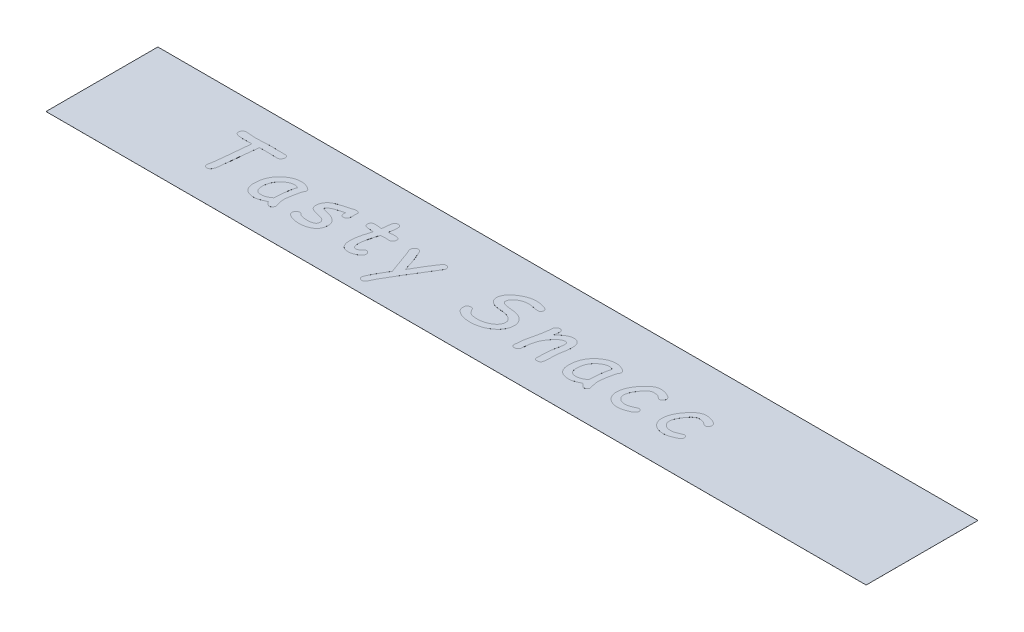
from build123d import *

# Parameters (mm, degrees)
SKETCH1_W           = 139.7
SKETCH1_H           = 19.05
BOSS_EXTRUDE1_DEPTH = 0.00254
BOSS_EXTRUDE2_DEPTH = 0.00254


with BuildPart() as part:
    # Sketch1 → Boss-Extrude1 (new body)
    with BuildSketch(Plane(origin=(0, 0, 0), x_dir=(1, 0, 0), z_dir=(0, 1, 0))):
        with Locations((21.475842697, 18.407865169)):
            Rectangle(SKETCH1_W, SKETCH1_H)
    extrude(amount=BOSS_EXTRUDE1_DEPTH)

    # Sketch2 → Boss-Extrude2 (add)
    # profile 1 of 10: a face of its own
    with BuildSketch(Plane(origin=(0, 0.00254, 0), x_dir=(1, 0, 0), z_dir=(0, 1, 0))):
        with BuildLine():
            Line((-21.817173463, 21.706055429), (-22.095146827, 21.706055429))
            add(Edge.make_bspline(
                [(-22.095146827, 21.706055429), (-22.190665043, 21.706525307), (-22.375987498, 21.707436954), (-22.644836576, 21.710432013), (-22.896545622, 21.717031578), (-23.058340645, 21.724665331), (-23.136689, 21.728361934)],
                knots=[0, 0, 0, 0, 1.100148141, 2.13448452, 3.096634333, 4, 4, 4, 4], degree=3))
            Line((-23.136689, 21.728361934), (-23.599977941, 21.740373129))
            Line((-23.599977941, 21.740373129), (-24.248582457, 21.740373129))
            add(Edge.make_bspline(
                [(-24.248582457, 21.740373129), (-24.285788754, 21.73973417), (-24.357442066, 21.73850364), (-24.428775056, 21.731654586), (-24.463068078, 21.728361934)],
                knots=[0, 0, 0, 0, 1.038508765, 2, 2, 2, 2], degree=3))
            Line((-24.463068078, 21.728361934), (-24.869732814, 21.718066624))
            add(Edge.make_bspline(
                [(-24.869732814, 21.718066624), (-24.876515558, 21.646564288), (-24.891064627, 21.493190892), (-24.916221417, 21.247032287), (-24.951600878, 20.970446743), (-24.97667748, 20.775471006), (-24.989844762, 20.673092681)],
                knots=[0, 0, 0, 0, 0.81932944, 1.757471786, 2.822487942, 4, 4, 4, 4], degree=3))
            add(Edge.make_bspline(
                [(-24.989844762, 20.673092681), (-25.005079669, 20.560462489), (-25.036985786, 20.324583673), (-25.079360568, 19.95504484), (-25.119088164, 19.554069863), (-25.141313517, 19.276403675), (-25.152853833, 19.132227983)],
                knots=[0, 0, 0, 0, 0.880061847, 1.84309325, 2.880045399, 4, 4, 4, 4], degree=3))
            add(Edge.make_bspline(
                [(-25.152853833, 19.132227983), (-25.16539596, 18.985802484), (-25.189552037, 18.703787652), (-25.225057225, 18.297018392), (-25.261122805, 17.922946454), (-25.296750962, 17.58142181), (-25.333318619, 17.272679761), (-25.36679429, 16.996227059), (-25.401191185, 16.752626782), (-25.424940127, 16.60127198), (-25.435974852, 16.530946377)],
                knots=[0, 0, 0, 0, 1.347631239, 2.595531534, 3.744202209, 4.793723348, 5.744200094, 6.595111808, 7.347231756, 8, 8, 8, 8], degree=3))
            Line((-25.435974852, 16.530946377), (-25.494314941, 15.92009133))
            add(Edge.make_bspline(
                [(-25.494314941, 15.92009133), (-25.4982284, 15.852543955), (-25.505803237, 15.721800184), (-25.527575462, 15.533166402), (-25.55090806, 15.357321338), (-25.579606972, 15.193922058), (-25.61505592, 15.043751811), (-25.65718243, 14.907313164), (-25.700657716, 14.782608031), (-25.75213133, 14.671353907), (-25.808436197, 14.57272038), (-25.870788179, 14.487651126), (-25.937385749, 14.415466191), (-26.009276106, 14.354704353), (-26.087904373, 14.309060533), (-26.171616593, 14.275473159), (-26.260468862, 14.256469764), (-26.321284638, 14.25367466), (-26.352257423, 14.252251144)],
                knots=[0, 0, 0, 0, 1.579455687, 3.057172773, 4.432109037, 5.720945312, 6.929145715, 8.03176677, 9.054066961, 10.010108075, 10.889686176, 11.701683054, 12.467098675, 13.17840931, 13.890722144, 14.580133196, 15.276877929, 16, 16, 16, 16], degree=3))
            add(Edge.make_bspline(
                [(-26.352257423, 14.252251144), (-26.38501734, 14.25391146), (-26.45041688, 14.257225996), (-26.545505127, 14.283660617), (-26.634616423, 14.32787517), (-26.716242519, 14.386746576), (-26.784081906, 14.459872812), (-26.836109747, 14.541913606), (-26.866213528, 14.634032381), (-26.870154322, 14.69816871), (-26.872170567, 14.730983049)],
                knots=[0, 0, 0, 0, 1.002940062, 2.002197344, 2.997758225, 4.039023705, 5.068419142, 6.036441886, 6.99537651, 8, 8, 8, 8], degree=3))
            add(Edge.make_bspline(
                [(-26.872170567, 14.730983049), (-26.870889891, 14.75106), (-26.867864599, 14.798486989), (-26.850018901, 14.878881676), (-26.827100485, 14.980714484), (-26.804144289, 15.054297777), (-26.791523974, 15.094750662)],
                knots=[0, 0, 0, 0, 0.64556026, 1.524981497, 2.639342801, 4, 4, 4, 4], degree=3))
            add(Edge.make_bspline(
                [(-26.791523974, 15.094750662), (-26.784443519, 15.120434145), (-26.768953138, 15.176623601), (-26.748549019, 15.270561656), (-26.728368262, 15.381637366), (-26.707942524, 15.509814066), (-26.687825557, 15.655246452), (-26.664520925, 15.8174196), (-26.645286179, 15.997902846), (-26.630891328, 16.123721042), (-26.623367248, 16.189485269)],
                knots=[0, 0, 0, 0, 0.576663616, 1.261605128, 2.080039382, 3.020505263, 4.071157582, 5.258415363, 6.566994285, 8, 8, 8, 8], degree=3))
            add(Edge.make_bspline(
                [(-26.623367248, 16.189485269), (-26.617644224, 16.242105366), (-26.606758182, 16.342196607), (-26.591260474, 16.485181223), (-26.577323693, 16.613849996), (-26.56594116, 16.728946273), (-26.553661483, 16.829521066), (-26.54303546, 16.915842186), (-26.535373303, 16.987538416), (-26.528564788, 17.030288267), (-26.525561805, 17.049143636)],
                knots=[0, 0, 0, 0, 1.468148939, 2.792637389, 3.989239469, 5.057959703, 6.000541697, 6.799467432, 7.470489737, 8, 8, 8, 8], degree=3))
            add(Edge.make_bspline(
                [(-26.525561805, 17.049143636), (-26.514876985, 17.113717745), (-26.492042171, 17.251720805), (-26.464098019, 17.473372746), (-26.434631214, 17.722722724), (-26.406044721, 17.999061423), (-26.376704665, 18.30276268), (-26.347270348, 18.633303183), (-26.320434458, 18.992030006), (-26.302969833, 19.240322053), (-26.293917335, 19.369020108)],
                knots=[0, 0, 0, 0, 0.67349781, 1.43935022, 2.298658675, 3.257418402, 4.298166967, 5.438553734, 6.672316912, 8, 8, 8, 8], degree=3))
            add(Edge.make_bspline(
                [(-26.293917335, 19.369020108), (-26.283183753, 19.498294317), (-26.262518088, 19.74718957), (-26.230623003, 20.105375732), (-26.196054038, 20.433625411), (-26.171696562, 20.642227243), (-26.160078307, 20.741728079)],
                knots=[0, 0, 0, 0, 1.128556501, 2.172841423, 3.128464954, 4, 4, 4, 4], degree=3))
            Line((-26.160078307, 20.741728079), (-26.055409324, 21.64771534))
            Line((-26.055409324, 21.64771534), (-26.884181762, 21.623692951))
            add(Edge.make_bspline(
                [(-26.884181762, 21.623692951), (-26.965392411, 21.621050785), (-27.122638545, 21.615934826), (-27.351483063, 21.61429013), (-27.56604569, 21.617432846), (-27.766292545, 21.626047956), (-27.952475769, 21.638676153), (-28.123893887, 21.660505852), (-28.281831654, 21.682686721), (-28.4243001, 21.714138913), (-28.551622394, 21.748918282), (-28.662308073, 21.791475452), (-28.755850652, 21.840984971), (-28.832440386, 21.896568259), (-28.895070176, 21.956030018), (-28.936808252, 22.025691299), (-28.964293299, 22.100409558), (-28.967410836, 22.153090065), (-28.968981994, 22.179639679)],
                knots=[0, 0, 0, 0, 1.680370449, 3.253658958, 4.732461028, 6.117705823, 7.398727365, 8.590103989, 9.690891264, 10.695512653, 11.605415951, 12.418174328, 13.143219478, 13.786781356, 14.372282161, 14.913963244, 15.452665545, 16, 16, 16, 16], degree=3))
            add(Edge.make_bspline(
                [(-28.968981994, 22.179639679), (-28.967019072, 22.230829134), (-28.963189422, 22.330699502), (-28.923302902, 22.472725731), (-28.863593891, 22.603330391), (-28.776586193, 22.715133126), (-28.675379465, 22.810537071), (-28.558399794, 22.878280598), (-28.431240257, 22.919989607), (-28.34300028, 22.925142047), (-28.298070973, 22.927765524)],
                knots=[0, 0, 0, 0, 1.095821785, 2.137942811, 3.142745013, 4.159101758, 5.158189684, 6.109775599, 7.03755106, 8, 8, 8, 8], degree=3))
            add(Edge.make_bspline(
                [(-28.298070973, 22.927765524), (-28.278628048, 22.927105132), (-28.234599525, 22.925609675), (-28.160091799, 22.925381414), (-28.069359095, 22.916280488), (-28.00295553, 22.912603113), (-27.966905175, 22.910606674)],
                knots=[0, 0, 0, 0, 0.703859573, 1.593890723, 2.693728338, 4, 4, 4, 4], degree=3))
            add(Edge.make_bspline(
                [(-27.966905175, 22.910606674), (-27.887413196, 22.90305419), (-27.735336686, 22.888605494), (-27.51741088, 22.869755679), (-27.32009343, 22.854080906), (-27.143291261, 22.842340762), (-26.987131014, 22.832405496), (-26.851696401, 22.822363689), (-26.736624168, 22.819700948), (-26.666835643, 22.818493254), (-26.635378442, 22.817948886)],
                knots=[0, 0, 0, 0, 1.435421764, 2.746112681, 3.932147303, 4.993626446, 5.931311422, 6.745207213, 7.434401734, 8, 8, 8, 8], degree=3))
            add(Edge.make_bspline(
                [(-26.635378442, 22.817948886), (-26.524984656, 22.819349128), (-26.288704916, 22.822346117), (-25.912792367, 22.834019199), (-25.492482363, 22.857802225), (-25.198024852, 22.876659016), (-25.043037196, 22.886584285)],
                knots=[0, 0, 0, 0, 0.831089472, 1.77881029, 2.830877204, 4, 4, 4, 4], degree=3))
            add(Edge.make_bspline(
                [(-25.043037196, 22.886584285), (-24.950408596, 22.893395761), (-24.772116685, 22.906506519), (-24.513438521, 22.917125387), (-24.273830531, 22.927546857), (-24.119901816, 22.927694665), (-24.046108031, 22.927765524)],
                knots=[0, 0, 0, 0, 1.11667688, 2.149384258, 3.112810495, 4, 4, 4, 4], degree=3))
            add(Edge.make_bspline(
                [(-24.046108031, 22.927765524), (-23.975185223, 22.92722747), (-23.823038947, 22.926073218), (-23.578756319, 22.923468444), (-23.302553685, 22.913500775), (-23.107519837, 22.907114373), (-23.004565858, 22.903743134)],
                knots=[0, 0, 0, 0, 0.81689663, 1.75243739, 2.813562287, 4, 4, 4, 4], degree=3))
            Line((-23.004565858, 22.903743134), (-22.234133509, 22.893447825))
            add(Edge.make_bspline(
                [(-22.234133509, 22.893447825), (-22.149463445, 22.891869381), (-21.976124903, 22.888637954), (-21.760177533, 22.891422544), (-21.590248984, 22.892810773), (-21.477172366, 22.870856852), (-21.378356341, 22.838545102), (-21.298418366, 22.785522689), (-21.234445815, 22.72093973), (-21.18865871, 22.642629646), (-21.160434225, 22.551590396), (-21.157885839, 22.4864258), (-21.156557751, 22.452465389)],
                knots=[0, 0, 0, 0, 1.910164941, 3.910534514, 4.878779214, 5.731801791, 6.499208571, 7.207945679, 7.874166361, 8.533729065, 9.235855556, 10, 10, 10, 10], degree=3))
            add(Edge.make_bspline(
                [(-21.156557751, 22.452465389), (-21.158929834, 22.405350819), (-21.163622841, 22.312137814), (-21.199211814, 22.176805903), (-21.256835946, 22.048957221), (-21.336320371, 21.932802363), (-21.432868929, 21.832216603), (-21.547317362, 21.757525144), (-21.677884969, 21.712929923), (-21.769925735, 21.70838731), (-21.817173463, 21.706055429)],
                knots=[0, 0, 0, 0, 1.019760971, 2.017528466, 3.010204884, 4.044689978, 5.052333947, 6.01125975, 6.979110434, 8, 8, 8, 8], degree=3))
        make_face()
    # profile 2 of 10: a face of its own
    with BuildSketch(Plane(origin=(0, 0.00254, 0), x_dir=(1, 0, 0), z_dir=(0, 1, 0))):
        with BuildLine():
            add(Edge.make_bspline(
                [(-16.140339647, 14.525076854), (-16.240879654, 14.477912737), (-16.433216264, 14.387686104), (-16.711180354, 14.26236406), (-16.968110007, 14.15998248), (-17.202703517, 14.07526327), (-17.4139236, 14.006885883), (-17.604479591, 13.960976184), (-17.771593116, 13.928213941), (-17.876693135, 13.924502273), (-17.92486001, 13.922801231)],
                knots=[0, 0, 0, 0, 1.406452878, 2.690594383, 3.860833914, 4.90795398, 5.849538507, 6.669986229, 7.390460565, 8, 8, 8, 8], degree=3))
            add(Edge.make_bspline(
                [(-17.92486001, 13.922801231), (-18.01243088, 13.924455782), (-18.182196467, 13.927663306), (-18.428178163, 13.952098897), (-18.657425252, 13.990483861), (-18.870159583, 14.047070126), (-19.065182788, 14.120906826), (-19.245388814, 14.208296257), (-19.405932015, 14.314987693), (-19.551032197, 14.43651408), (-19.678643363, 14.575135538), (-19.790696761, 14.729573627), (-19.883618098, 14.901294563), (-19.958555952, 15.088146907), (-20.02017696, 15.290434202), (-20.058733044, 15.509992902), (-20.0860628, 15.744958919), (-20.088861617, 15.906848267), (-20.090306835, 15.990442613)],
                knots=[0, 0, 0, 0, 1.223616787, 2.372113238, 3.450991798, 4.468928708, 5.442824108, 6.36152391, 7.261605421, 8.129487454, 9.000565981, 9.887958326, 10.78935209, 11.721514677, 12.697670801, 13.738633428, 14.832304526, 16, 16, 16, 16], degree=3))
            add(Edge.make_bspline(
                [(-20.090306835, 15.990442613), (-20.086865822, 16.146773708), (-20.080124043, 16.453064329), (-20.021850635, 16.900996933), (-19.929236498, 17.32689523), (-19.79357339, 17.72861509), (-19.624115903, 18.109309729), (-19.413146302, 18.465090307), (-19.166468816, 18.799655591), (-18.882256408, 19.104336703), (-18.578309432, 19.380953169), (-18.263682258, 19.625432387), (-17.939870966, 19.829291958), (-17.611227047, 20.000884658), (-17.271813743, 20.128835697), (-16.927096649, 20.22473534), (-16.573437858, 20.280933817), (-16.335571289, 20.288405345), (-16.215838585, 20.292166219)],
                knots=[0, 0, 0, 0, 1.167309924, 2.287043932, 3.368170618, 4.417936975, 5.448646987, 6.475204615, 7.501451026, 8.547585701, 9.581910964, 10.568917146, 11.519512756, 12.436685347, 13.333287665, 14.22360778, 15.105833815, 16, 16, 16, 16], degree=3))
            add(Edge.make_bspline(
                [(-16.215838585, 20.292166219), (-16.121228053, 20.288868975), (-15.928839949, 20.282164114), (-15.639194995, 20.225971068), (-15.345491742, 20.135831619), (-15.104324973, 20.032860327), (-14.918509955, 19.939514996), (-14.79568995, 19.864353332), (-14.692430582, 19.784693111), (-14.60492176, 19.705178249), (-14.538107004, 19.619804466), (-14.491387814, 19.53076838), (-14.459563498, 19.439221937), (-14.456735987, 19.376132381), (-14.455340612, 19.344997718)],
                knots=[0, 0, 0, 0, 1.585415806, 3.223902606, 4.92894085, 6.72985054, 7.613471042, 8.414590831, 9.139709703, 9.797863579, 10.392581835, 10.946040531, 11.479871549, 12, 12, 12, 12], degree=3))
            add(Edge.make_bspline(
                [(-14.455340612, 19.344997718), (-14.457180515, 19.307567352), (-14.460696976, 19.236029695), (-14.491285612, 19.135675548), (-14.538854614, 19.046157696), (-14.587178711, 19.000676011), (-14.611486144, 18.977798336)],
                knots=[0, 0, 0, 0, 1.087650609, 2.078739377, 3.033589514, 4, 4, 4, 4], degree=3))
            add(Edge.make_bspline(
                [(-14.611486144, 18.977798336), (-14.622267743, 18.955112679), (-14.647584793, 18.901842856), (-14.677323011, 18.80463917), (-14.716324832, 18.683573517), (-14.755195337, 18.535110127), (-14.795282597, 18.359559519), (-14.842516354, 18.158098032), (-14.889514854, 17.929518874), (-14.940060097, 17.682586048), (-14.988088261, 17.432045077), (-15.031503605, 17.192466459), (-15.067572842, 16.972222671), (-15.09632863, 16.770171699), (-15.121913056, 16.587406909), (-15.136137496, 16.422389571), (-15.147991817, 16.276589129), (-15.149549763, 16.185501374), (-15.150274022, 16.143156375)],
                knots=[0, 0, 0, 0, 0.416112136, 0.977102839, 1.682240627, 2.526755852, 3.520807656, 4.669149321, 5.958516358, 7.391078151, 8.849724315, 10.189511302, 11.429384313, 12.550964596, 13.574676125, 14.489377356, 15.297739685, 16, 16, 16, 16], degree=3))
            add(Edge.make_bspline(
                [(-15.150274022, 16.143156375), (-15.149030053, 16.092802642), (-15.146411032, 15.986789249), (-15.132481715, 15.821204557), (-15.107564115, 15.642217411), (-15.074780928, 15.449983143), (-15.033736748, 15.243827668), (-14.981919927, 15.024158475), (-14.919782467, 14.790973689), (-14.873734677, 14.631379865), (-14.849994154, 14.549099243)],
                knots=[0, 0, 0, 0, 0.742913488, 1.564110045, 2.449503797, 3.407982253, 4.440508896, 5.549748789, 6.736741884, 8, 8, 8, 8], degree=3))
            Line((-14.849994154, 14.549099243), (-14.825971764, 14.456441455))
            add(Edge.make_bspline(
                [(-14.825971764, 14.456441455), (-14.837137449, 14.414175928), (-14.858522056, 14.333228658), (-14.911941703, 14.224447315), (-14.972378733, 14.129841831), (-15.048761206, 14.053631386), (-15.137381385, 13.995620789), (-15.237084192, 13.950702495), (-15.350032802, 13.928001502), (-15.428737162, 13.924573543), (-15.469428626, 13.922801231)],
                knots=[0, 0, 0, 0, 1.144501069, 2.191957406, 3.166184543, 4.0790347, 4.999138107, 5.933458546, 6.931563702, 8, 8, 8, 8], degree=3))
            add(Edge.make_bspline(
                [(-15.469428626, 13.922801231), (-15.487421481, 13.926634404), (-15.532060598, 13.936144261), (-15.604133346, 13.978193316), (-15.692777922, 14.045374574), (-15.796719634, 14.131044637), (-15.901979407, 14.229261225), (-15.995467369, 14.330469439), (-16.076890759, 14.426299959), (-16.119827815, 14.493144141), (-16.140339647, 14.525076854)],
                knots=[0, 0, 0, 0, 0.479567811, 1.189776934, 2.154510672, 3.399225703, 4.713302123, 5.921519624, 7.007071174, 8, 8, 8, 8], degree=3))
        make_face()
        with BuildLine():
            add(Edge.make_bspline(
                [(-15.718231946, 19.046433735), (-15.775437217, 19.079018953), (-15.881432609, 19.139395958), (-16.036391276, 19.206991663), (-16.1729175, 19.250492813), (-16.259070889, 19.257662803), (-16.298201064, 19.260919355)],
                knots=[0, 0, 0, 0, 1.264339708, 2.342689419, 3.247262902, 4, 4, 4, 4], degree=3))
            add(Edge.make_bspline(
                [(-16.298201064, 19.260919355), (-16.378453016, 19.258314392), (-16.538303315, 19.253125681), (-16.775558947, 19.210040481), (-17.007715401, 19.140941062), (-17.236663369, 19.045991897), (-17.460225277, 18.920949149), (-17.67982855, 18.768722537), (-17.897442763, 18.591613385), (-18.104839076, 18.387473764), (-18.300667056, 18.165398641), (-18.470280423, 17.924273601), (-18.61516788, 17.670990746), (-18.735330143, 17.404906404), (-18.82534082, 17.124239533), (-18.890670353, 16.83078658), (-18.93105022, 16.524057764), (-18.936283496, 16.314868783), (-18.938948024, 16.208360004)],
                knots=[0, 0, 0, 0, 0.864251023, 1.721463209, 2.589245069, 3.470578019, 4.386467009, 5.343803541, 6.346810527, 7.405889485, 8.476171031, 9.53295209, 10.57642203, 11.616464531, 12.672832156, 13.746426919, 14.852591009, 16, 16, 16, 16], degree=3))
            add(Edge.make_bspline(
                [(-18.938948024, 16.208360004), (-18.937642326, 16.156877114), (-18.935099983, 16.056633976), (-18.924641627, 15.911286626), (-18.900759742, 15.776415355), (-18.873524785, 15.650513533), (-18.832822939, 15.53579459), (-18.787642715, 15.429411645), (-18.729747822, 15.334619065), (-18.665438386, 15.248892566), (-18.591678036, 15.17323754), (-18.509426771, 15.108726731), (-18.418996939, 15.052239205), (-18.318506013, 15.008766695), (-18.21046899, 14.971457594), (-18.093116479, 14.949258498), (-17.968239398, 14.932455788), (-17.882028576, 14.930855206), (-17.837349877, 14.930025705)],
                knots=[0, 0, 0, 0, 1.279284475, 2.490914781, 3.614297383, 4.67911284, 5.685462276, 6.633146137, 7.544350149, 8.436529017, 9.290449556, 10.160177193, 11.027581214, 11.930552961, 12.873967954, 13.860263333, 14.891082931, 16, 16, 16, 16], degree=3))
            add(Edge.make_bspline(
                [(-17.837349877, 14.930025705), (-17.765761636, 14.932139137), (-17.623142718, 14.936349539), (-17.411006409, 14.966192419), (-17.202432829, 15.016133241), (-16.997321327, 15.086912888), (-16.796247801, 15.178686904), (-16.597771109, 15.2894508), (-16.402160463, 15.419085004), (-16.278541789, 15.519246034), (-16.215838585, 15.570050797)],
                knots=[0, 0, 0, 0, 0.96477775, 1.922041372, 2.881289733, 3.851626615, 4.841850013, 5.856471407, 6.912736207, 8, 8, 8, 8], degree=3))
            add(Edge.make_bspline(
                [(-16.215838585, 15.570050797), (-16.207611026, 15.765710191), (-16.191747347, 16.142963996), (-16.153992165, 16.686505482), (-16.106709573, 17.186680599), (-16.048521708, 17.643291662), (-15.982395153, 18.056662063), (-15.908166705, 18.427066938), (-15.82264687, 18.753623883), (-15.751536112, 18.953039155), (-15.718231946, 19.046433735)],
                knots=[0, 0, 0, 0, 1.333323756, 2.570801475, 3.709290654, 4.753615095, 5.704362558, 6.559001163, 7.32511949, 8, 8, 8, 8], degree=3))
        make_face(mode=Mode.SUBTRACT)
    # profile 3 of 10: a face of its own
    with BuildSketch(Plane(origin=(0, 0.00254, 0), x_dir=(1, 0, 0), z_dir=(0, 1, 0))):
        with BuildLine():
            add(Edge.make_bspline(
                [(-7.948018473, 19.446234931), (-7.987474535, 19.435334208), (-8.071463827, 19.412130068), (-8.206333994, 19.375653886), (-8.358066748, 19.336799993), (-8.46506925, 19.309525297), (-8.521124051, 19.295237054)],
                knots=[0, 0, 0, 0, 0.828795451, 1.764239529, 2.828764679, 4, 4, 4, 4], degree=3))
            add(Edge.make_bspline(
                [(-8.521124051, 19.295237054), (-8.603606531, 19.273358475), (-8.762187441, 19.231294692), (-8.989656984, 19.163583177), (-9.19830563, 19.097818521), (-9.387284239, 19.030240988), (-9.557672112, 18.9656023), (-9.708745271, 18.901325582), (-9.839717452, 18.835096466), (-9.986759347, 18.754568995), (-10.138665565, 18.644982467), (-10.281688612, 18.497197532), (-10.384356457, 18.335714709), (-10.412192997, 18.21711094), (-10.425756362, 18.159321208)],
                knots=[0, 0, 0, 0, 1.320542722, 2.538876957, 3.672600749, 4.705656214, 5.644295815, 6.492752423, 7.24487347, 7.914614474, 9.086667498, 10.125961163, 11.086873871, 12, 12, 12, 12], degree=3))
            add(Edge.make_bspline(
                [(-10.425756362, 18.159321208), (-10.375680945, 18.14342281), (-10.271557371, 18.110364713), (-10.164097563, 18.090632854), (-10.108317643, 18.0803905)],
                knots=[0, 0, 0, 0, 0.961845904, 2, 2, 2, 2], degree=3))
            add(Edge.make_bspline(
                [(-10.108317643, 18.0803905), (-9.998879875, 18.060171353), (-9.786564853, 18.020945145), (-9.481601316, 17.948557068), (-9.199353179, 17.869704804), (-8.939809047, 17.785091812), (-8.704435827, 17.690633309), (-8.492528022, 17.589851276), (-8.303794882, 17.481633168), (-8.137686664, 17.365099304), (-7.993541134, 17.237766512), (-7.866978737, 17.102810519), (-7.762243278, 16.95555524), (-7.674666679, 16.799515229), (-7.608098528, 16.632047432), (-7.559677971, 16.454872495), (-7.532326764, 16.266972327), (-7.528087093, 16.138667115), (-7.525910772, 16.072805091)],
                knots=[0, 0, 0, 0, 1.485321868, 2.881602489, 4.182001012, 5.396386242, 6.52346978, 7.564973486, 8.526148044, 9.424312115, 10.268205716, 11.089415874, 11.88817412, 12.674206734, 13.472380986, 14.287285422, 15.120824108, 16, 16, 16, 16], degree=3))
            add(Edge.make_bspline(
                [(-7.525910772, 16.072805091), (-7.528155598, 15.989747663), (-7.532543674, 15.827391059), (-7.56859812, 15.591029169), (-7.630986358, 15.369468752), (-7.716645851, 15.162178935), (-7.827901674, 14.96989323), (-7.962910808, 14.791422217), (-8.123421387, 14.627918636), (-8.307959949, 14.481531952), (-8.510061909, 14.348586822), (-8.731516617, 14.236527507), (-8.966599711, 14.137536217), (-9.219106098, 14.059338055), (-9.486829791, 13.997097535), (-9.771040111, 13.956081758), (-10.069958956, 13.926776179), (-10.274681777, 13.92414663), (-10.379427468, 13.922801231)],
                knots=[0, 0, 0, 0, 0.990302867, 1.935795677, 2.842854973, 3.729679918, 4.603740324, 5.485117389, 6.392022759, 7.328490064, 8.289676469, 9.272100381, 10.28434035, 11.328577712, 12.420736527, 13.559168667, 14.751157468, 16, 16, 16, 16], degree=3))
            add(Edge.make_bspline(
                [(-10.379427468, 13.922801231), (-10.516285173, 13.926560499), (-10.783063408, 13.93388848), (-11.172733922, 13.987118042), (-11.539035804, 14.079176195), (-11.827118772, 14.180829682), (-12.035465584, 14.282538754), (-12.171492612, 14.361871655), (-12.286257666, 14.448165888), (-12.380790909, 14.540052939), (-12.455372829, 14.637320349), (-12.508520837, 14.741252833), (-12.540763938, 14.850891385), (-12.544640732, 14.92638264), (-12.546590178, 14.964343405)],
                knots=[0, 0, 0, 0, 1.89041844, 3.685013517, 5.419316331, 7.101558884, 7.893113473, 8.619434973, 9.27367325, 9.871517822, 10.435675445, 10.958657963, 11.47636133, 12, 12, 12, 12], degree=3))
            add(Edge.make_bspline(
                [(-12.546590178, 14.964343405), (-12.544148381, 15.008760723), (-12.539272747, 15.097450599), (-12.49352797, 15.224139658), (-12.422931584, 15.342795513), (-12.326024749, 15.447366409), (-12.215124458, 15.536313056), (-12.098846856, 15.605633838), (-11.975975577, 15.645400583), (-11.89310032, 15.651219357), (-11.851656767, 15.65412916)],
                knots=[0, 0, 0, 0, 0.990161677, 1.977096311, 2.975157026, 4.061813854, 5.144473805, 6.147113554, 7.07342434, 8, 8, 8, 8], degree=3))
            add(Edge.make_bspline(
                [(-11.851656767, 15.65412916), (-11.820811125, 15.650150388), (-11.752111763, 15.641288872), (-11.650936352, 15.583421465), (-11.541043555, 15.497733011), (-11.472437482, 15.422622407), (-11.434696721, 15.381303451)],
                knots=[0, 0, 0, 0, 0.725111331, 1.614966768, 2.687973748, 4, 4, 4, 4], degree=3))
            add(Edge.make_bspline(
                [(-11.434696721, 15.381303451), (-11.409235107, 15.359386415), (-11.351014634, 15.309270967), (-11.229183649, 15.25935115), (-11.076195745, 15.206966972), (-10.893917073, 15.165302413), (-10.702843211, 15.128050506), (-10.519879299, 15.103804716), (-10.354684283, 15.083959172), (-10.250215259, 15.081963983), (-10.200975431, 15.081023582)],
                knots=[0, 0, 0, 0, 0.622725996, 1.423923945, 2.425194387, 3.643055435, 4.901760187, 6.053627168, 7.082607857, 8, 8, 8, 8], degree=3))
            add(Edge.make_bspline(
                [(-10.200975431, 15.081023582), (-10.139769905, 15.08182084), (-10.021301497, 15.083364001), (-9.849488385, 15.091257025), (-9.689316535, 15.107349776), (-9.540730904, 15.126714132), (-9.403779134, 15.154470128), (-9.279315714, 15.188173759), (-9.166523695, 15.228216307), (-9.064732054, 15.271952482), (-8.974683359, 15.323482612), (-8.897131243, 15.382035556), (-8.831108222, 15.445799096), (-8.776706884, 15.515304512), (-8.734816242, 15.591809617), (-8.706592576, 15.674972671), (-8.685834404, 15.763509884), (-8.684710379, 15.825016291), (-8.684133123, 15.856603586)],
                knots=[0, 0, 0, 0, 1.547500188, 2.995315851, 4.346386943, 5.616325607, 6.781866495, 7.876353202, 8.873365852, 9.805677462, 10.673764899, 11.48931926, 12.256249649, 12.988021786, 13.712759559, 14.449089294, 15.203512676, 16, 16, 16, 16], degree=3))
            add(Edge.make_bspline(
                [(-8.684133123, 15.856603586), (-8.687012328, 15.909003541), (-8.692630091, 16.011243756), (-8.739584762, 16.157543236), (-8.815101358, 16.290454774), (-8.920355228, 16.411021102), (-9.057434226, 16.515447216), (-9.22239389, 16.607673768), (-9.416166108, 16.689151414), (-9.558109912, 16.728237159), (-9.633017508, 16.748863767)],
                knots=[0, 0, 0, 0, 0.8892498, 1.735060473, 2.584218694, 3.473415321, 4.436340391, 5.498987448, 6.680147814, 8, 8, 8, 8], degree=3))
            Line((-9.633017508, 16.748863767), (-10.212986626, 16.88098691))
            add(Edge.make_bspline(
                [(-10.212986626, 16.88098691), (-10.284646331, 16.897499839), (-10.421774726, 16.929099068), (-10.61554673, 16.984508135), (-10.788773613, 17.040228157), (-10.941327602, 17.098790859), (-11.072860139, 17.158837567), (-11.182520071, 17.2235903), (-11.273034727, 17.287025721), (-11.362169588, 17.376871409), (-11.442461062, 17.498471076), (-11.514002572, 17.650441266), (-11.559683633, 17.811250046), (-11.564424771, 17.92166089), (-11.566819863, 17.977437402)],
                knots=[0, 0, 0, 0, 1.38393533, 2.64830605, 3.792216516, 4.807857144, 5.72294752, 6.50951203, 7.202881054, 7.796659826, 8.880639667, 9.925806794, 10.952174819, 12, 12, 12, 12], degree=3))
            add(Edge.make_bspline(
                [(-11.566819863, 17.977437402), (-11.563582134, 18.062932398), (-11.557112852, 18.233759305), (-11.502581235, 18.486206176), (-11.418706291, 18.733341602), (-11.299981591, 18.971765267), (-11.149921006, 19.194868047), (-10.97163789, 19.398549464), (-10.763749364, 19.576371497), (-10.566773379, 19.702813012), (-10.392752088, 19.798877156), (-10.240712116, 19.8674002), (-10.072981106, 19.940977134), (-9.885186854, 20.009326616), (-9.681787833, 20.082680377), (-9.458994151, 20.151717741), (-9.21993048, 20.224775527), (-9.053199974, 20.269243815), (-8.967254142, 20.292166219)],
                knots=[0, 0, 0, 0, 1.081068301, 2.160074395, 3.254368517, 4.377775814, 5.520218015, 6.648652184, 7.793477244, 8.970087724, 9.605036705, 10.307836528, 11.079686685, 11.922735717, 12.836282274, 13.81617245, 14.874285934, 16, 16, 16, 16], degree=3))
            add(Edge.make_bspline(
                [(-8.967254142, 20.292166219), (-8.900268808, 20.308496705), (-8.771820523, 20.339811364), (-8.588073342, 20.388931165), (-8.419240075, 20.432250007), (-8.267525242, 20.477340429), (-8.131520013, 20.518890838), (-8.010642497, 20.55554402), (-7.906888711, 20.593373729), (-7.843299213, 20.618629905), (-7.814179446, 20.630195557)],
                knots=[0, 0, 0, 0, 1.375989506, 2.638540134, 3.795927859, 4.854342352, 5.796837149, 6.634433623, 7.374661292, 8, 8, 8, 8], degree=3))
            add(Edge.make_bspline(
                [(-7.814179446, 20.630195557), (-7.774487683, 20.646137063), (-7.693798079, 20.678544641), (-7.563621652, 20.707859218), (-7.425847823, 20.727473314), (-7.330947412, 20.730090118), (-7.282255107, 20.73143277)],
                knots=[0, 0, 0, 0, 0.940315664, 1.911572912, 2.928452168, 4, 4, 4, 4], degree=3))
            add(Edge.make_bspline(
                [(-7.282255107, 20.73143277), (-7.243787331, 20.730532195), (-7.171812541, 20.728847182), (-7.07147363, 20.705692343), (-6.985824618, 20.670268786), (-6.914270622, 20.61946509), (-6.859923012, 20.55211558), (-6.822122437, 20.4701777), (-6.797336846, 20.37481895), (-6.795769246, 20.306064483), (-6.794943777, 20.269859714)],
                knots=[0, 0, 0, 0, 1.197993153, 2.241494388, 3.193016698, 4.074858796, 4.950174013, 5.860283439, 6.873266774, 8, 8, 8, 8], degree=3))
            Line((-6.794943777, 20.269859714), (-6.824113822, 19.854615553))
            Line((-6.824113822, 19.854615553), (-6.812102627, 19.466825551))
            add(Edge.make_bspline(
                [(-6.812102627, 19.466825551), (-6.812427864, 19.425654883), (-6.813051752, 19.346678836), (-6.817873432, 19.232755912), (-6.836399908, 19.130443315), (-6.857581057, 19.037354669), (-6.888290753, 18.956393204), (-6.924659156, 18.884323523), (-6.970697102, 18.825009617), (-7.039549959, 18.761585329), (-7.133053362, 18.70179801), (-7.247938668, 18.648262807), (-7.365380183, 18.61257627), (-7.445019339, 18.608966907), (-7.484729533, 18.607167184)],
                knots=[0, 0, 0, 0, 1.190408741, 2.283513546, 3.28910735, 4.191268401, 5.038758059, 5.785624988, 6.516400534, 7.194811361, 8.483236294, 9.703686256, 10.854997102, 12, 12, 12, 12], degree=3))
            add(Edge.make_bspline(
                [(-7.484729533, 18.607167184), (-7.53072299, 18.6086416), (-7.614280157, 18.611320199), (-7.727037321, 18.641946544), (-7.815032543, 18.693563307), (-7.875905215, 18.775405899), (-7.909156223, 18.888252834), (-7.930963758, 19.036483712), (-7.945967255, 19.226900755), (-7.947290744, 19.368419761), (-7.948018473, 19.446234931)],
                knots=[0, 0, 0, 0, 0.982532738, 1.784985464, 2.478228101, 3.124902096, 3.91501663, 4.970059794, 6.333967163, 8, 8, 8, 8], degree=3))
        make_face()
    # profile 4 of 10: a face of its own
    with BuildSketch(Plane(origin=(0, 0.00254, 0), x_dir=(1, 0, 0), z_dir=(0, 1, 0))):
        with BuildLine():
            add(Edge.make_bspline(
                [(-1.624296026, 19.070456124), (-1.636683951, 19.022358426), (-1.662397747, 18.922521335), (-1.70640922, 18.767978559), (-1.751623268, 18.600890486), (-1.786416093, 18.486392206), (-1.804463947, 18.426999262)],
                knots=[0, 0, 0, 0, 0.891853466, 1.851233221, 2.885384266, 4, 4, 4, 4], degree=3))
            add(Edge.make_bspline(
                [(-1.804463947, 18.426999262), (-1.842511436, 18.297826449), (-1.915921628, 18.048595778), (-2.017584641, 17.685587209), (-2.098287876, 17.34502084), (-2.168499009, 17.028513083), (-2.221910148, 16.736025517), (-2.259580196, 16.466392283), (-2.28622834, 16.220906877), (-2.288831886, 16.064285614), (-2.290059392, 15.990442613)],
                knots=[0, 0, 0, 0, 1.2968838, 2.502254241, 3.629850726, 4.667058255, 5.6243375, 6.492141564, 7.289082534, 8, 8, 8, 8], degree=3))
            add(Edge.make_bspline(
                [(-2.290059392, 15.990442613), (-2.289157776, 15.913145398), (-2.287470296, 15.768474574), (-2.26464427, 15.566539168), (-2.231555934, 15.393953123), (-2.179702743, 15.253163029), (-2.117528732, 15.139383193), (-2.034321248, 15.059127085), (-1.935255815, 15.008461558), (-1.863386726, 15.003105714), (-1.826770452, 15.000376989)],
                knots=[0, 0, 0, 0, 1.533940842, 2.870950571, 4.031477807, 5.012508983, 5.842309257, 6.581335254, 7.277210557, 8, 8, 8, 8], degree=3))
            add(Edge.make_bspline(
                [(-1.826770452, 15.000376989), (-1.755467233, 15.003178053), (-1.619762591, 15.008509051), (-1.430904054, 15.061682933), (-1.27015207, 15.152633535), (-1.190454827, 15.239953629), (-1.150711776, 15.283498008)],
                knots=[0, 0, 0, 0, 1.12486292, 2.140844734, 3.072885075, 4, 4, 4, 4], degree=3))
            add(Edge.make_bspline(
                [(-1.150711776, 15.283498008), (-1.103287168, 15.342990913), (-1.016580701, 15.451761861), (-0.87346741, 15.577160764), (-0.735110276, 15.661803088), (-0.639123397, 15.672984357), (-0.594765047, 15.67815155)],
                knots=[0, 0, 0, 0, 1.294959161, 2.36757537, 3.245608729, 4, 4, 4, 4], degree=3))
            add(Edge.make_bspline(
                [(-0.594765047, 15.67815155), (-0.563128668, 15.676536238), (-0.49867974, 15.67324556), (-0.403554483, 15.644529134), (-0.311682431, 15.596521159), (-0.224300893, 15.534537725), (-0.145817693, 15.459191188), (-0.090658581, 15.367230462), (-0.053581944, 15.265663921), (-0.05062604, 15.193464115), (-0.049113629, 15.156522521)],
                knots=[0, 0, 0, 0, 0.908827001, 1.851442154, 2.83027879, 3.880518674, 4.927789036, 5.932565037, 6.942180769, 8, 8, 8, 8], degree=3))
            add(Edge.make_bspline(
                [(-0.049113629, 15.156522521), (-0.051172165, 15.114593683), (-0.05525519, 15.031429485), (-0.085870299, 14.90907522), (-0.135431956, 14.791550557), (-0.208780819, 14.680162839), (-0.299095946, 14.572297842), (-0.411419254, 14.470498236), (-0.541901887, 14.372966435), (-0.739580636, 14.251914362), (-1.000355339, 14.122954668), (-1.32099837, 14.00887027), (-1.641020376, 13.935637863), (-1.854998951, 13.927043189), (-1.960609479, 13.922801231)],
                knots=[0, 0, 0, 0, 0.610135022, 1.210178786, 1.825973808, 2.459102908, 3.144894054, 3.869980412, 4.661323287, 5.514276695, 7.242811401, 8.886827144, 10.463473135, 12, 12, 12, 12], degree=3))
            add(Edge.make_bspline(
                [(-1.960609479, 13.922801231), (-2.020741632, 13.923894511), (-2.138015086, 13.926026694), (-2.308022216, 13.949048191), (-2.466663474, 13.984734784), (-2.614093138, 14.033894459), (-2.748696265, 14.100467446), (-2.873611322, 14.178371382), (-2.983831172, 14.274999672), (-3.084258021, 14.383105141), (-3.172078114, 14.506937274), (-3.250300421, 14.644248519), (-3.31175979, 14.798046609), (-3.366794703, 14.963645312), (-3.404605497, 15.145181014), (-3.43332855, 15.340555073), (-3.453370858, 15.550196481), (-3.454542151, 15.694689762), (-3.455145283, 15.769093453)],
                knots=[0, 0, 0, 0, 1.061993521, 2.071165635, 3.024915796, 3.932625067, 4.809540004, 5.673073309, 6.525953751, 7.391436677, 8.27496643, 9.202655878, 10.176805171, 11.196399824, 12.282785033, 13.44771131, 14.68575412, 16, 16, 16, 16], degree=3))
            add(Edge.make_bspline(
                [(-3.455145283, 15.769093453), (-3.453909004, 15.856080093), (-3.451375646, 16.034331372), (-3.427020535, 16.308498093), (-3.391236807, 16.5964229), (-3.340903682, 16.898548167), (-3.277457159, 17.215172181), (-3.197970274, 17.545106622), (-3.105507299, 17.88980955), (-3.033796924, 18.122364928), (-2.997003997, 18.241683686)],
                knots=[0, 0, 0, 0, 0.827045054, 1.694764134, 2.615661492, 3.585869529, 4.606716759, 5.685888046, 6.812682945, 8, 8, 8, 8], degree=3))
            add(Edge.make_bspline(
                [(-2.997003997, 18.241683686), (-2.957105982, 18.369673009), (-2.877293976, 18.625702898), (-2.802675988, 18.883294471), (-2.765359527, 19.012116035)],
                knots=[0, 0, 0, 0, 0.999799851, 2, 2, 2, 2], degree=3))
            add(Edge.make_bspline(
                [(-2.765359527, 19.012116035), (-2.864338609, 19.017379458), (-3.05154605, 19.027334612), (-3.315768613, 19.04833095), (-3.546383452, 19.070031401), (-3.74336381, 19.093470389), (-3.906875512, 19.119841568), (-4.036856812, 19.150549092), (-4.135268776, 19.180075613), (-4.219665272, 19.228049206), (-4.288479621, 19.305872279), (-4.346730667, 19.413875837), (-4.380473462, 19.543251138), (-4.384663906, 19.635932159), (-4.386870818, 19.684742941)],
                knots=[0, 0, 0, 0, 1.805098719, 3.414134651, 4.82689538, 6.023321385, 7.026845722, 7.840416686, 8.456413321, 8.890553951, 9.590646681, 10.313088806, 11.111582364, 12, 12, 12, 12], degree=3))
            add(Edge.make_bspline(
                [(-4.386870818, 19.684742941), (-4.385122634, 19.725569687), (-4.381712948, 19.805198798), (-4.348306074, 19.919118596), (-4.291039693, 20.020845548), (-4.215787924, 20.111932015), (-4.121117205, 20.188956261), (-4.006539962, 20.24160413), (-3.877473847, 20.275511334), (-3.785971333, 20.278563678), (-3.738266302, 20.280155024)],
                knots=[0, 0, 0, 0, 0.989344073, 1.92963187, 2.849397303, 3.805846448, 4.783822878, 5.783730849, 6.844543331, 8, 8, 8, 8], degree=3))
            Line((-3.738266302, 20.280155024), (-2.540578597, 20.182349581))
            add(Edge.make_bspline(
                [(-2.540578597, 20.182349581), (-2.529427212, 20.237126265), (-2.505856388, 20.352908447), (-2.493759827, 20.47045498), (-2.487386163, 20.532390114)],
                knots=[0, 0, 0, 0, 0.946202302, 2, 2, 2, 2], degree=3))
            add(Edge.make_bspline(
                [(-2.487386163, 20.532390114), (-2.482730685, 20.602784727), (-2.472914282, 20.751216724), (-2.456533122, 20.899070783), (-2.447920809, 20.976804319)],
                knots=[0, 0, 0, 0, 0.948509947, 2, 2, 2, 2], degree=3))
            Line((-2.447920809, 20.976804319), (-2.348399481, 21.702623659))
            add(Edge.make_bspline(
                [(-2.348399481, 21.702623659), (-2.341514657, 21.741463082), (-2.327940574, 21.818038689), (-2.27821031, 21.923262733), (-2.21712584, 22.022296663), (-2.133644799, 22.106452235), (-2.039217504, 22.1789804), (-1.932983334, 22.230726188), (-1.818967514, 22.263394625), (-1.740055986, 22.267017361), (-1.699794964, 22.268865698)],
                knots=[0, 0, 0, 0, 1.004272309, 1.98001814, 2.953788552, 3.967602352, 4.991495741, 5.985812325, 6.972352253, 8, 8, 8, 8], degree=3))
            add(Edge.make_bspline(
                [(-1.699794964, 22.268865698), (-1.661679579, 22.266928852), (-1.587940014, 22.263181752), (-1.486094403, 22.223755829), (-1.399303296, 22.160826845), (-1.329681987, 22.071627394), (-1.277578356, 21.958033138), (-1.240801384, 21.821180086), (-1.216472221, 21.661154892), (-1.214989107, 21.546008519), (-1.214199519, 21.484706269)],
                knots=[0, 0, 0, 0, 0.876146821, 1.695029086, 2.479234366, 3.324505157, 4.275154144, 5.344998267, 6.586515785, 8, 8, 8, 8], degree=3))
            add(Edge.make_bspline(
                [(-1.214199519, 21.484706269), (-1.214686517, 21.444057043), (-1.215731584, 21.356826192), (-1.231946795, 21.217949674), (-1.250922942, 21.061909411), (-1.271843524, 20.95324733), (-1.282834918, 20.896157726)],
                knots=[0, 0, 0, 0, 0.821569007, 1.763038828, 2.824730515, 4, 4, 4, 4], degree=3))
            Line((-1.282834918, 20.896157726), (-1.399515096, 20.194360776))
            add(Edge.make_bspline(
                [(-1.399515096, 20.194360776), (-1.338297236, 20.201653619), (-1.223821849, 20.215290997), (-1.063820431, 20.236478426), (-0.926546821, 20.253642435), (-0.811573253, 20.267276107), (-0.718970971, 20.278178015), (-0.649021717, 20.283932066), (-0.602278854, 20.290161904), (-0.578755903, 20.291656929), (-0.570742658, 20.292166219)],
                knots=[0, 0, 0, 0, 1.772863891, 3.315197225, 4.641267031, 5.75110233, 6.644753205, 7.322317683, 7.76914312, 8, 8, 8, 8], degree=3))
            add(Edge.make_bspline(
                [(-0.570742658, 20.292166219), (-0.478040962, 20.291232245), (-0.308323556, 20.289522336), (-0.07671956, 20.268556486), (0.107951558, 20.232823733), (0.252431957, 20.182900522), (0.359748288, 20.107417172), (0.433155935, 20.005428052), (0.477030377, 19.878562315), (0.480797711, 19.785790334), (0.48281071, 19.73621949)],
                knots=[0, 0, 0, 0, 1.634633332, 2.992671565, 4.094585841, 4.947003633, 5.669352503, 6.369454494, 7.128750778, 8, 8, 8, 8], degree=3))
            add(Edge.make_bspline(
                [(0.48281071, 19.73621949), (0.48058659, 19.691387986), (0.476259702, 19.604171077), (0.440182225, 19.479560424), (0.375467592, 19.3709367), (0.291973434, 19.276505418), (0.190096752, 19.201515445), (0.077138394, 19.145359166), (-0.047194792, 19.111603575), (-0.133554933, 19.10822226), (-0.177805001, 19.106489708)],
                knots=[0, 0, 0, 0, 1.053855524, 2.050210535, 3.014985784, 4.006238724, 4.996669238, 5.971620442, 6.960678724, 8, 8, 8, 8], degree=3))
            Line((-0.177805001, 19.106489708), (-0.750910579, 19.128796213))
            add(Edge.make_bspline(
                [(-0.750910579, 19.128796213), (-0.895207852, 19.126675223), (-1.187342125, 19.122381215), (-1.477472909, 19.08790374), (-1.624296026, 19.070456124)],
                knots=[0, 0, 0, 0, 0.987883219, 2, 2, 2, 2], degree=3))
        make_face()
    # profile 5 of 10: a face of its own
    with BuildSketch(Plane(origin=(0, 0.00254, 0), x_dir=(1, 0, 0), z_dir=(0, 1, 0))):
        with BuildLine():
            add(Edge.make_bspline(
                [(6.128758597, 15.062148848), (6.038079724, 14.915343039), (5.863118873, 14.632087761), (5.61560835, 14.220280646), (5.387002578, 13.84165037), (5.180180334, 13.494086685), (4.995904598, 13.177179276), (4.830206464, 12.892648705), (4.687707967, 12.638388177), (4.600899468, 12.47867991), (4.560439739, 12.404243038)],
                knots=[0, 0, 0, 0, 1.34173892, 2.588825574, 3.735988398, 4.780952993, 5.733684657, 6.586539124, 7.341213773, 8, 8, 8, 8], degree=3))
            Line((4.560439739, 12.404243038), (4.004493011, 11.268327191))
            add(Edge.make_bspline(
                [(4.004493011, 11.268327191), (3.987554732, 11.235256183), (3.954683679, 11.171077357), (3.894266115, 11.086027037), (3.830296071, 11.011833888), (3.759844686, 10.951486121), (3.683509538, 10.904295874), (3.601725813, 10.871245354), (3.514626458, 10.852129966), (3.454930898, 10.849350928), (3.424523893, 10.847935375)],
                knots=[0, 0, 0, 0, 1.173151263, 2.276660831, 3.288690307, 4.263367423, 5.196754043, 6.113353353, 7.039002649, 8, 8, 8, 8], degree=3))
            add(Edge.make_bspline(
                [(3.424523893, 10.847935375), (3.38950299, 10.849636833), (3.321453046, 10.852942975), (3.223342615, 10.877155403), (3.134717456, 10.919402754), (3.055154527, 10.975719323), (2.989220582, 11.047056984), (2.944850826, 11.132836017), (2.913111786, 11.22664557), (2.910898899, 11.293781908), (2.909758404, 11.328383165)],
                knots=[0, 0, 0, 0, 1.064531684, 2.068516632, 3.048871508, 4.03353701, 5.018663245, 5.968136723, 6.952802224, 8, 8, 8, 8], degree=3))
            add(Edge.make_bspline(
                [(2.909758404, 11.328383165), (2.911425806, 11.353633587), (2.915217734, 11.411056883), (2.938012984, 11.50639169), (2.974658381, 11.619806619), (3.02306686, 11.752721586), (3.085034512, 11.904011719), (3.163005386, 12.073378879), (3.253988035, 12.262142613), (3.358889836, 12.469685575), (3.477422114, 12.696134814), (3.609640594, 12.941476824), (3.755727118, 13.20560488), (3.914972021, 13.489261756), (4.090826691, 13.79012576), (4.277149198, 14.112086102), (4.480132141, 14.451207143), (4.6204176, 14.683558012), (4.692562882, 14.803050218)],
                knots=[0, 0, 0, 0, 0.309349308, 0.703507322, 1.195130898, 1.768808065, 2.434530905, 3.19595774, 4.050893532, 4.999681641, 6.042572734, 7.179755249, 8.411374347, 9.737544177, 11.16185405, 12.677382311, 14.291261328, 16, 16, 16, 16], degree=3))
            Line((4.692562882, 14.803050218), (3.244355972, 18.811357494))
            Line((3.244355972, 18.811357494), (3.053892741, 19.243760505))
            add(Edge.make_bspline(
                [(3.053892741, 19.243760505), (3.028634637, 19.305847747), (2.981490534, 19.421733223), (2.971172577, 19.546278105), (2.966382608, 19.604096348)],
                knots=[0, 0, 0, 0, 1.071527583, 2, 2, 2, 2], degree=3))
            add(Edge.make_bspline(
                [(2.966382608, 19.604096348), (2.968660384, 19.649140235), (2.973152249, 19.737968545), (3.020423808, 19.864526484), (3.088839361, 19.984025822), (3.187752207, 20.086914799), (3.29722828, 20.176503612), (3.414655769, 20.243324449), (3.53693449, 20.283542913), (3.619851558, 20.28929151), (3.661316018, 20.292166219)],
                knots=[0, 0, 0, 0, 1.003400893, 1.978745848, 2.988329584, 4.066090757, 5.149308215, 6.146159424, 7.072947206, 8, 8, 8, 8], degree=3))
            add(Edge.make_bspline(
                [(3.661316018, 20.292166219), (3.691805489, 20.290550848), (3.752192345, 20.287351475), (3.840709525, 20.260268786), (3.923044586, 20.214243838), (3.992481548, 20.161310847), (4.047956603, 20.092499225), (4.100377869, 20.008644941), (4.162987021, 19.892730252), (4.238787784, 19.74580258), (4.321940945, 19.564828074), (4.415949942, 19.351639704), (4.522516719, 19.107385721), (4.677719885, 18.732347657), (4.879704044, 18.225613242), (5.10558296, 17.577104924), (5.328344812, 16.889376065), (5.463889227, 16.414137798), (5.533346514, 16.170610534)],
                knots=[0, 0, 0, 0, 0.314088307, 0.622077231, 0.944154427, 1.284160194, 1.514562471, 1.851689395, 2.303260899, 2.873214118, 3.556850499, 4.357186878, 5.276773025, 6.305641961, 8.543989445, 10.90264591, 13.38795299, 16, 16, 16, 16], degree=3))
            Line((5.533346514, 16.170610534), (6.708727715, 18.173048288))
            add(Edge.make_bspline(
                [(6.708727715, 18.173048288), (6.761605868, 18.261893153), (6.873090033, 18.449206724), (7.055532133, 18.740623467), (7.26009107, 19.057846869), (7.441455457, 19.334490117), (7.591505071, 19.553819171), (7.696043802, 19.70320183), (7.790270003, 19.833770874), (7.873989969, 19.944981193), (7.946758264, 20.037559562), (8.013459913, 20.106622015), (8.064581963, 20.162625237), (8.146121, 20.22014455), (8.260370983, 20.275362543), (8.366215144, 20.286788375), (8.416033254, 20.292166219)],
                knots=[0, 0, 0, 0, 1.556164555, 3.28089572, 5.174609011, 7.237617843, 8.259630072, 9.174377797, 9.982022552, 10.682799944, 11.270362497, 11.751622066, 12.129047409, 12.406279656, 13.249877027, 14, 14, 14, 14], degree=3))
            add(Edge.make_bspline(
                [(8.416033254, 20.292166219), (8.451689662, 20.290795479), (8.520732205, 20.288141276), (8.619613652, 20.259441315), (8.708346646, 20.211976726), (8.78721924, 20.148736356), (8.851258711, 20.07256027), (8.900180301, 19.987650063), (8.927931258, 19.894080449), (8.9309788, 19.829048644), (8.932514628, 19.796275464)],
                knots=[0, 0, 0, 0, 1.070837808, 2.073494491, 3.066945484, 4.08325437, 5.097227581, 6.045341531, 7.014937766, 8, 8, 8, 8], degree=3))
            add(Edge.make_bspline(
                [(8.932514628, 19.796275464), (8.93112779, 19.768126683), (8.928263004, 19.709979894), (8.905699646, 19.621322919), (8.871719966, 19.528435681), (8.839487844, 19.467619194), (8.822697991, 19.435939621)],
                knots=[0, 0, 0, 0, 0.886816924, 1.831893113, 2.870623672, 4, 4, 4, 4], degree=3))
            Line((8.822697991, 19.435939621), (6.128758597, 15.062148848))
        make_face()
    # profile 6 of 10: a face of its own
    with BuildSketch(Plane(origin=(0, 0.00254, 0), x_dir=(1, 0, 0), z_dir=(0, 1, 0))):
        with BuildLine():
            add(Edge.make_bspline(
                [(16.68797149, 16.244393588), (16.734364461, 16.240344599), (16.825903641, 16.232355434), (16.954733913, 16.169767603), (17.061296738, 16.062932942), (17.113318476, 15.973021754), (17.140965121, 15.925238985)],
                knots=[0, 0, 0, 0, 0.949651521, 1.873782164, 2.870034107, 4, 4, 4, 4], degree=3))
            add(Edge.make_bspline(
                [(17.140965121, 15.925238985), (17.177421021, 15.857914425), (17.245087649, 15.732951773), (17.348517138, 15.566670889), (17.444728718, 15.435733983), (17.537501792, 15.333691777), (17.643368387, 15.256567344), (17.768715752, 15.195416696), (17.915416762, 15.135645601), (18.086685526, 15.088296116), (18.276571016, 15.046253606), (18.484613793, 15.021179848), (18.707145827, 15.000190506), (18.861366585, 14.999181596), (18.940928448, 14.998661104)],
                knots=[0, 0, 0, 0, 1.264418839, 2.346916674, 3.231159435, 3.946205604, 4.615078389, 5.379820062, 6.244673654, 7.228298172, 8.310383705, 9.454058108, 10.686558906, 12, 12, 12, 12], degree=3))
            add(Edge.make_bspline(
                [(18.940928448, 14.998661104), (19.034211878, 15.000301995), (19.218281152, 15.003539843), (19.491319269, 15.029551155), (19.756415604, 15.074774871), (20.015968316, 15.134289362), (20.267638923, 15.213315463), (20.512744734, 15.310324745), (20.751034543, 15.423106351), (20.979083667, 15.552172587), (21.189877607, 15.69404054), (21.376737253, 15.846279518), (21.534203479, 16.008881964), (21.665253649, 16.178579712), (21.763920071, 16.360560837), (21.836655678, 16.549436027), (21.881567269, 16.747921898), (21.886384218, 16.88304422), (21.888818817, 16.951338193)],
                knots=[0, 0, 0, 0, 1.152153613, 2.27345928, 3.383849995, 4.472082426, 5.560314857, 6.638756165, 7.725887192, 8.814280152, 9.872443103, 10.861179091, 11.785520437, 12.663016582, 13.500909312, 14.332793421, 15.157354916, 16, 16, 16, 16], degree=3))
            add(Edge.make_bspline(
                [(21.888818817, 16.951338193), (21.886804289, 16.999534963), (21.882856702, 17.093979435), (21.85258944, 17.232364729), (21.802679358, 17.362953716), (21.732954606, 17.486912281), (21.642297276, 17.602033467), (21.533107407, 17.71122109), (21.403304685, 17.811905386), (21.255674171, 17.906040995), (21.091282476, 17.991166999), (20.912644445, 18.066244749), (20.72118155, 18.131644139), (20.516488325, 18.186441754), (20.297956929, 18.230153195), (20.066302524, 18.266988248), (19.821005955, 18.290390974), (19.653063351, 18.297901147), (19.56722646, 18.30173966)],
                knots=[0, 0, 0, 0, 0.78286415, 1.534069432, 2.290262357, 3.047825404, 3.836244387, 4.664487035, 5.551573321, 6.500552623, 7.506769793, 8.556532631, 9.64719455, 10.792732392, 11.997827437, 13.267897482, 14.603599204, 16, 16, 16, 16], degree=3))
            add(Edge.make_bspline(
                [(19.56722646, 18.30173966), (19.485962258, 18.307420901), (19.32769808, 18.318485267), (19.097112912, 18.344810324), (18.880976192, 18.385371493), (18.677434991, 18.431880355), (18.487928935, 18.492714503), (18.311891924, 18.562552), (18.148480254, 18.641136109), (18.001521465, 18.732461124), (17.867971733, 18.831386966), (17.753076057, 18.941215683), (17.655094712, 19.059856669), (17.574437442, 19.186368347), (17.511284524, 19.321805617), (17.46932866, 19.466613116), (17.440266141, 19.618951235), (17.437500534, 19.724067406), (17.436097334, 19.777400729)],
                knots=[0, 0, 0, 0, 1.356704337, 2.642217501, 3.862290525, 5.017536643, 6.117127997, 7.173151657, 8.170035197, 9.132321295, 10.050602459, 10.933210454, 11.77233914, 12.607402913, 13.425728044, 14.251448992, 15.112828838, 16, 16, 16, 16], degree=3))
            add(Edge.make_bspline(
                [(17.436097334, 19.777400729), (17.440056352, 19.869253603), (17.447965765, 20.052759329), (17.512464763, 20.323893251), (17.6190412, 20.587395621), (17.767439247, 20.844015171), (17.953535362, 21.096400229), (18.185410722, 21.338863382), (18.457900767, 21.574660883), (18.76324482, 21.802022134), (19.089099536, 22.010097531), (19.418835398, 22.196185649), (19.74630552, 22.355641411), (20.073883457, 22.482591051), (20.398424997, 22.58266858), (20.72115379, 22.655722332), (21.042199277, 22.700302299), (21.256093619, 22.705538564), (21.362042133, 22.708132248)],
                knots=[0, 0, 0, 0, 0.829281667, 1.656757461, 2.503271015, 3.389874974, 4.328494051, 5.330302404, 6.414553493, 7.581603651, 8.767263479, 9.905834819, 11.001567824, 12.055433847, 13.077241401, 14.067827549, 15.042934942, 16, 16, 16, 16], degree=3))
            add(Edge.make_bspline(
                [(21.362042133, 22.708132248), (21.473708745, 22.705547448), (21.700131773, 22.700306326), (22.040861027, 22.655136122), (22.386743636, 22.584496566), (22.671982403, 22.503187196), (22.890793196, 22.427724305), (23.0336091, 22.365246997), (23.156930488, 22.303261135), (23.25735539, 22.235230602), (23.335180707, 22.162046615), (23.391301065, 22.085619549), (23.42956072, 22.005097096), (23.433095714, 21.948383701), (23.43483117, 21.92054105)],
                knots=[0, 0, 0, 0, 1.711250537, 3.469851216, 5.259974234, 7.119591362, 8.012578217, 8.805852095, 9.507861333, 10.125635435, 10.658988351, 11.136033702, 11.575847784, 12, 12, 12, 12], degree=3))
            add(Edge.make_bspline(
                [(23.43483117, 21.92054105), (23.433195457, 21.89060838), (23.429826257, 21.828953829), (23.400638293, 21.737725141), (23.354049244, 21.64735165), (23.295290325, 21.557293422), (23.213086122, 21.477024267), (23.10555859, 21.420365373), (22.975642821, 21.388164967), (22.882511957, 21.383991737), (22.832555547, 21.381753171)],
                knots=[0, 0, 0, 0, 0.793094408, 1.633595649, 2.51623131, 3.488933067, 4.476800224, 5.52972091, 6.674915408, 8, 8, 8, 8], degree=3))
            add(Edge.make_bspline(
                [(22.832555547, 21.381753171), (22.783304796, 21.383243215), (22.673528627, 21.38656441), (22.493337251, 21.411745998), (22.279909536, 21.447695719), (22.127222803, 21.479554086), (22.044964349, 21.496717464)],
                knots=[0, 0, 0, 0, 0.741299796, 1.65230074, 2.735200439, 4, 4, 4, 4], degree=3))
            add(Edge.make_bspline(
                [(22.044964349, 21.496717464), (21.958738725, 21.516296108), (21.800511906, 21.552223555), (21.580682402, 21.591903115), (21.400398494, 21.618159213), (21.292321498, 21.623212973), (21.245361955, 21.625408836)],
                knots=[0, 0, 0, 0, 1.307916653, 2.400069503, 3.304828901, 4, 4, 4, 4], degree=3))
            add(Edge.make_bspline(
                [(21.245361955, 21.625408836), (21.158933777, 21.623721553), (20.98917138, 21.620407388), (20.73930734, 21.595449411), (20.499264334, 21.557331727), (20.27001611, 21.499954439), (20.051409814, 21.427910913), (19.842569926, 21.340580045), (19.644928657, 21.23526644), (19.459997768, 21.116426371), (19.291962391, 20.988903373), (19.142808432, 20.858677552), (19.017413181, 20.725348741), (18.914298635, 20.589692428), (18.832473032, 20.452775814), (18.774789348, 20.3123601), (18.741186093, 20.169622834), (18.735923748, 20.073842966), (18.733306367, 20.026204049)],
                knots=[0, 0, 0, 0, 1.277805574, 2.509868231, 3.709812212, 4.86878847, 6.000124068, 7.110688326, 8.211678576, 9.307295647, 10.357748428, 11.328427649, 12.231972635, 13.059138034, 13.843878821, 14.583621353, 15.295522674, 16, 16, 16, 16], degree=3))
            add(Edge.make_bspline(
                [(18.733306367, 20.026204049), (18.734803522, 19.999796738), (18.737700574, 19.948697582), (18.755262216, 19.874138123), (18.785832532, 19.804754498), (18.832753658, 19.742983523), (18.887700053, 19.683169177), (18.956954975, 19.630286922), (19.039201404, 19.584523953), (19.13395852, 19.540273863), (19.247699365, 19.500629132), (19.384741775, 19.466043259), (19.545190374, 19.429265781), (19.731146322, 19.398395128), (19.940327876, 19.365250299), (20.174253254, 19.334157656), (20.433077746, 19.307948512), (20.613909209, 19.290576756), (20.708289961, 19.281509975)],
                knots=[0, 0, 0, 0, 0.558170603, 1.080081438, 1.610325597, 2.147143282, 2.711562258, 3.323318133, 3.978556403, 4.697899902, 5.531394804, 6.519553269, 7.683886084, 9.009496482, 10.502074612, 12.160451242, 13.996037338, 16, 16, 16, 16], degree=3))
            add(Edge.make_bspline(
                [(20.708289961, 19.281509975), (20.800513311, 19.273583206), (20.979979547, 19.258157749), (21.241069981, 19.215101557), (21.485655664, 19.154923047), (21.71558364, 19.081646701), (21.929096367, 18.99201829), (22.127948291, 18.888233849), (22.30836481, 18.764336879), (22.475080594, 18.630308579), (22.62234937, 18.482095174), (22.751726245, 18.326282233), (22.860759418, 18.161643793), (22.951053126, 17.989538475), (23.01951351, 17.807780823), (23.069827225, 17.618203908), (23.099137796, 17.420114109), (23.103283072, 17.285458179), (23.105381256, 17.217300363)],
                knots=[0, 0, 0, 0, 1.265177177, 2.462029266, 3.613256214, 4.706284662, 5.757739504, 6.775686145, 7.76684963, 8.745096762, 9.696150073, 10.618280866, 11.509660781, 12.391037663, 13.269669844, 14.159230018, 15.068270806, 16, 16, 16, 16], degree=3))
            add(Edge.make_bspline(
                [(23.105381256, 17.217300363), (23.101441937, 17.103205799), (23.09368511, 16.878544725), (23.031454919, 16.548595725), (22.930219421, 16.232286106), (22.785711483, 15.930272154), (22.602997094, 15.641368938), (22.376370967, 15.369543277), (22.112603061, 15.109056196), (21.810667083, 14.86733986), (21.483048094, 14.646086099), (21.135965458, 14.454152281), (20.777116706, 14.286867354), (20.400841727, 14.156645223), (20.012032145, 14.050027345), (19.607682989, 13.97784759), (19.18966024, 13.931673016), (18.906162856, 13.925785322), (18.762476412, 13.922801231)],
                knots=[0, 0, 0, 0, 0.907228014, 1.786402568, 2.661386196, 3.542783847, 4.44290792, 5.374006282, 6.352241256, 7.387735853, 8.446673582, 9.49377242, 10.540396501, 11.592506732, 12.65776176, 13.744923993, 14.857048167, 16, 16, 16, 16], degree=3))
            add(Edge.make_bspline(
                [(18.762476412, 13.922801231), (18.670349392, 13.924062566), (18.489290692, 13.926541487), (18.222372026, 13.947787102), (17.964493398, 13.981581085), (17.716099838, 14.030187369), (17.476363497, 14.088797216), (17.247975135, 14.166020559), (17.027244339, 14.252027165), (16.820327821, 14.355004531), (16.628255497, 14.465404961), (16.461697058, 14.589648634), (16.318055109, 14.720179903), (16.202167403, 14.861969558), (16.111100784, 15.012597737), (16.047761424, 15.172737372), (16.005579203, 15.340811592), (16.001810016, 15.45654494), (15.999901619, 15.515142478)],
                knots=[0, 0, 0, 0, 1.260889452, 2.478046116, 3.662818389, 4.819023851, 5.94125103, 7.038037219, 8.116791274, 9.181216407, 10.199011829, 11.144790317, 12.02012099, 12.849165889, 13.642700337, 14.41905499, 15.199543721, 16, 16, 16, 16], degree=3))
            add(Edge.make_bspline(
                [(15.999901619, 15.515142478), (16.002301605, 15.574881713), (16.006816649, 15.687267941), (16.046014554, 15.842941953), (16.111603852, 15.974086104), (16.207189545, 16.074476659), (16.3176627, 16.148092988), (16.434269946, 16.205403848), (16.559156138, 16.238824237), (16.64488513, 16.242530743), (16.68797149, 16.244393588)],
                knots=[0, 0, 0, 0, 1.265488826, 2.3807388, 3.379207385, 4.340650711, 5.282918909, 6.183738585, 7.087168865, 8, 8, 8, 8], degree=3))
        make_face()
    # profile 7 of 10: a face of its own
    with BuildSketch(Plane(origin=(0, 0.00254, 0), x_dir=(1, 0, 0), z_dir=(0, 1, 0))):
        with BuildLine():
            add(Edge.make_bspline(
                [(27.824751262, 19.106489708), (27.919990308, 19.209136716), (28.103372407, 19.406782793), (28.391377638, 19.66986544), (28.673668383, 19.894549555), (28.952801777, 20.077775392), (29.226538465, 20.223111632), (29.497869819, 20.325595461), (29.765933631, 20.389005217), (29.944123901, 20.397716939), (30.031379326, 20.401982856)],
                knots=[0, 0, 0, 0, 1.276827556, 2.458522308, 3.554489237, 4.564567166, 5.500361951, 6.375426232, 7.204485887, 8, 8, 8, 8], degree=3))
            add(Edge.make_bspline(
                [(30.031379326, 20.401982856), (30.081793539, 20.401392157), (30.180145443, 20.400239776), (30.322286688, 20.379813827), (30.45578092, 20.352395459), (30.577812831, 20.308433645), (30.690936996, 20.255173707), (30.794582853, 20.190004276), (30.887792864, 20.111390652), (30.973365766, 20.022486259), (31.044309058, 19.91780729), (31.108436149, 19.803775656), (31.163981972, 19.678386865), (31.205796396, 19.539710649), (31.239699142, 19.390591985), (31.266465165, 19.22973327), (31.278864964, 19.056354546), (31.28110399, 18.93663033), (31.282259465, 18.874845238)],
                knots=[0, 0, 0, 0, 1.070584252, 2.088577665, 3.04734078, 3.962558129, 4.838150996, 5.701673177, 6.556333192, 7.425061217, 8.315553875, 9.235523958, 10.204639116, 11.223721098, 12.309116237, 13.454485887, 14.686357467, 16, 16, 16, 16], degree=3))
            add(Edge.make_bspline(
                [(31.282259465, 18.874845238), (31.281665026, 18.810768341), (31.280432708, 18.67793188), (31.267440284, 18.470762426), (31.246759258, 18.248820446), (31.228292138, 18.095793336), (31.218771722, 18.016902756)],
                knots=[0, 0, 0, 0, 0.893108135, 1.851483598, 2.892368126, 4, 4, 4, 4], degree=3))
            Line((31.218771722, 18.016902756), (31.028308491, 16.927315804))
            add(Edge.make_bspline(
                [(31.028308491, 16.927315804), (31.015308144, 16.847940311), (30.986985966, 16.675015171), (30.96385828, 16.391182886), (30.948304973, 16.063264404), (30.94676479, 15.829746343), (30.945946012, 15.705605709)],
                knots=[0, 0, 0, 0, 0.787007745, 1.7145522, 2.785032134, 4, 4, 4, 4], degree=3))
            add(Edge.make_bspline(
                [(30.945946012, 15.705605709), (30.946002077, 15.612364811), (30.946109074, 15.43441676), (30.936504972, 15.181600464), (30.925456357, 14.955528069), (30.908683615, 14.756884057), (30.887060129, 14.584979737), (30.86027542, 14.440401828), (30.829031844, 14.322627747), (30.780427549, 14.205151045), (30.698650852, 14.08869506), (30.564688547, 13.989434475), (30.397225486, 13.931527849), (30.276089135, 13.92583461), (30.211547248, 13.922801231)],
                knots=[0, 0, 0, 0, 1.53828576, 2.935782027, 4.173813478, 5.272584059, 6.224240883, 7.031214496, 7.69752065, 8.230365041, 9.123361605, 10.006681643, 10.937952748, 12, 12, 12, 12], degree=3))
            add(Edge.make_bspline(
                [(30.211547248, 13.922801231), (30.171927195, 13.924239686), (30.096887479, 13.926964095), (29.992958098, 13.952488371), (29.905153524, 13.994371159), (29.833821344, 14.05361743), (29.783344473, 14.133226145), (29.748967944, 14.227900628), (29.732416791, 14.339219975), (29.734920525, 14.418086377), (29.736247112, 14.459873225)],
                knots=[0, 0, 0, 0, 1.138439726, 2.15618575, 3.054055029, 3.917954686, 4.785139441, 5.732752323, 6.798713615, 8, 8, 8, 8], degree=3))
            Line((29.736247112, 14.459873225), (29.770564812, 15.698742169))
            add(Edge.make_bspline(
                [(29.770564812, 15.698742169), (29.774402208, 15.787444826), (29.782584435, 15.976579668), (29.811617705, 16.276379123), (29.852704116, 16.610620886), (29.899113527, 16.905885168), (29.93957091, 17.146997176), (29.968166995, 17.317079042), (29.997243708, 17.470869085), (30.02583444, 17.608945961), (30.048336786, 17.731887582), (30.072640922, 17.839423739), (30.09663687, 17.930675777), (30.111985522, 17.98659998), (30.11888946, 18.011755101)],
                knots=[0, 0, 0, 0, 1.364102098, 2.908585227, 4.626641464, 6.538396856, 7.500697682, 8.383539861, 9.188533759, 9.90557502, 10.550231911, 11.108866951, 11.599161749, 12, 12, 12, 12], degree=3))
            add(Edge.make_bspline(
                [(30.11888946, 18.011755101), (30.127072422, 18.06778086), (30.142832237, 18.175682567), (30.162737731, 18.331669692), (30.173120261, 18.475469996), (30.17474351, 18.56711691), (30.175513663, 18.610598954)],
                knots=[0, 0, 0, 0, 1.128476476, 2.173367049, 3.133350698, 4, 4, 4, 4], degree=3))
            add(Edge.make_bspline(
                [(30.175513663, 18.610598954), (30.174699527, 18.658706361), (30.173172964, 18.748911094), (30.15766765, 18.874696863), (30.134180242, 18.982538217), (30.094994633, 19.069827336), (30.050001464, 19.141764248), (29.989618489, 19.191500747), (29.918275048, 19.22082116), (29.86751177, 19.224614346), (29.840916095, 19.226601656)],
                knots=[0, 0, 0, 0, 1.471814891, 2.759755219, 3.876723793, 4.833249219, 5.678298145, 6.449553112, 7.187696652, 8, 8, 8, 8], degree=3))
            add(Edge.make_bspline(
                [(29.840916095, 19.226601656), (29.776533329, 19.223763642), (29.64599956, 19.218009669), (29.451882601, 19.165494352), (29.256136715, 19.088745183), (29.060986853, 18.976164859), (28.865451505, 18.83223639), (28.668108101, 18.658132859), (28.470631894, 18.452894031), (28.278890335, 18.221195993), (28.093455516, 17.979967774), (27.926551332, 17.737238009), (27.773543439, 17.504478556), (27.643021568, 17.276340546), (27.533314848, 17.053968562), (27.439451085, 16.84004877), (27.366245149, 16.631820021), (27.331846415, 16.49348764), (27.315133428, 16.426277394)],
                knots=[0, 0, 0, 0, 0.77654138, 1.57441003, 2.415014542, 3.3125303, 4.287097313, 5.344883713, 6.488586584, 7.724770759, 8.977115894, 10.163839211, 11.283356552, 12.342023096, 13.337249462, 14.278305502, 15.163496578, 16, 16, 16, 16], degree=3))
            add(Edge.make_bspline(
                [(27.315133428, 16.426277394), (27.30269919, 16.375906561), (27.276799042, 16.270985615), (27.248960531, 16.166561992), (27.234486835, 16.112270446)],
                knots=[0, 0, 0, 0, 0.960167351, 2, 2, 2, 2], degree=3))
            add(Edge.make_bspline(
                [(27.234486835, 16.112270446), (27.198546456, 15.980861125), (27.128172178, 15.723550645), (27.102777855, 15.458029586), (27.090352498, 15.328111017)],
                knots=[0, 0, 0, 0, 1.021406669, 2, 2, 2, 2], degree=3))
            Line((27.090352498, 15.328111017), (27.032012409, 14.597144022))
            add(Edge.make_bspline(
                [(27.032012409, 14.597144022), (27.025839601, 14.546994359), (27.014040022, 14.451131196), (26.967371634, 14.317171946), (26.902925946, 14.199428636), (26.817314586, 14.100464386), (26.718027347, 14.021914296), (26.607079156, 13.962263396), (26.48351214, 13.930425295), (26.397867277, 13.925374315), (26.354237848, 13.922801231)],
                knots=[0, 0, 0, 0, 1.143525654, 2.185896754, 3.196772946, 4.172210352, 5.132860959, 6.055782101, 7.009571458, 8, 8, 8, 8], degree=3))
            add(Edge.make_bspline(
                [(26.354237848, 13.922801231), (26.315767335, 13.923699615), (26.243787425, 13.925380527), (26.143482159, 13.948562312), (26.057722427, 13.983897188), (25.986906222, 14.03474274), (25.931343326, 14.100512595), (25.894545701, 14.181945049), (25.869075002, 14.276465224), (25.867671562, 14.344712245), (25.866926518, 14.380942517)],
                knots=[0, 0, 0, 0, 1.202660056, 2.250226355, 3.205455415, 4.090732818, 4.955647859, 5.869302707, 6.868877472, 8, 8, 8, 8], degree=3))
            Line((25.866926518, 14.380942517), (25.954436651, 15.345269867))
            add(Edge.make_bspline(
                [(25.954436651, 15.345269867), (25.958625053, 15.396786042), (25.967671895, 15.508059681), (25.990987997, 15.686495875), (26.021655951, 15.889151276), (26.062935047, 16.115159602), (26.115854134, 16.364028348), (26.173158881, 16.637339355), (26.242213823, 16.934140452), (26.293327092, 17.13958325), (26.319920149, 17.246470407)],
                knots=[0, 0, 0, 0, 0.63996497, 1.38230817, 2.227745963, 3.178002699, 4.226758812, 5.378383032, 6.636033054, 8, 8, 8, 8], degree=3))
            add(Edge.make_bspline(
                [(26.319920149, 17.246470407), (26.345885674, 17.357378276), (26.3966843, 17.574357036), (26.467092655, 17.892264344), (26.528805724, 18.19556194), (26.584128899, 18.482541211), (26.63028029, 18.754967963), (26.670359861, 19.011652269), (26.701218099, 19.253752227), (26.717167242, 19.410167953), (26.724869, 19.485700285)],
                knots=[0, 0, 0, 0, 1.200418392, 2.348483434, 3.431322089, 4.462180213, 5.428360603, 6.343080973, 7.199882512, 8, 8, 8, 8], degree=3))
            Line((26.724869, 19.485700285), (26.776345549, 19.979875155))
            add(Edge.make_bspline(
                [(26.776345549, 19.979875155), (26.782467374, 20.025523637), (26.79438518, 20.114390899), (26.843345732, 20.237092387), (26.907016838, 20.349011355), (26.993497151, 20.443973894), (27.094019143, 20.523245564), (27.206951827, 20.580988586), (27.330982418, 20.614510366), (27.416737179, 20.619197654), (27.46098365, 20.621616132)],
                knots=[0, 0, 0, 0, 1.066391905, 2.076023638, 3.047124568, 4.044963805, 5.039344625, 6.008260028, 6.97233151, 8, 8, 8, 8], degree=3))
            add(Edge.make_bspline(
                [(27.46098365, 20.621616132), (27.502512618, 20.619801872), (27.58126865, 20.616361288), (27.68995836, 20.577143827), (27.779979422, 20.512661256), (27.849926966, 20.422157588), (27.89743845, 20.306646918), (27.92489504, 20.168261263), (27.937191099, 20.005647606), (27.928783456, 19.88948494), (27.92427259, 19.827161393)],
                knots=[0, 0, 0, 0, 0.935570674, 1.774227397, 2.571054935, 3.409312678, 4.32464068, 5.369740621, 6.588814284, 8, 8, 8, 8], degree=3))
            Line((27.92427259, 19.827161393), (27.824751262, 19.106489708))
        make_face()
    # profile 8 of 10: a face of its own
    with BuildSketch(Plane(origin=(0, 0.00254, 0), x_dir=(1, 0, 0), z_dir=(0, 1, 0))):
        with BuildLine():
            add(Edge.make_bspline(
                [(37.472142886, 14.525076854), (37.371602878, 14.477912737), (37.179266268, 14.387686104), (36.901302178, 14.26236406), (36.644372525, 14.15998248), (36.409779015, 14.07526327), (36.198558932, 14.006885883), (36.008002941, 13.960976184), (35.840889416, 13.928213941), (35.735789397, 13.924502273), (35.687622523, 13.922801231)],
                knots=[0, 0, 0, 0, 1.406452878, 2.690594383, 3.860833914, 4.90795398, 5.849538507, 6.669986229, 7.390460565, 8, 8, 8, 8], degree=3))
            add(Edge.make_bspline(
                [(35.687622523, 13.922801231), (35.600051652, 13.924455782), (35.430286065, 13.927663306), (35.184304369, 13.952098897), (34.95505728, 13.990483861), (34.742322949, 14.047070126), (34.547299745, 14.120906826), (34.367093718, 14.208296257), (34.206550517, 14.314987693), (34.061450335, 14.43651408), (33.933839169, 14.575135538), (33.821785771, 14.729573627), (33.728864434, 14.901294563), (33.65392658, 15.088146907), (33.592305572, 15.290434202), (33.553749488, 15.509992902), (33.526419733, 15.744958919), (33.523620915, 15.906848267), (33.522175698, 15.990442613)],
                knots=[0, 0, 0, 0, 1.223616787, 2.372113238, 3.450991798, 4.468928708, 5.442824108, 6.36152391, 7.261605421, 8.129487454, 9.000565981, 9.887958326, 10.78935209, 11.721514677, 12.697670801, 13.738633428, 14.832304526, 16, 16, 16, 16], degree=3))
            add(Edge.make_bspline(
                [(33.522175698, 15.990442613), (33.52561671, 16.146773708), (33.532358489, 16.453064329), (33.590631898, 16.900996933), (33.683246034, 17.32689523), (33.818909142, 17.72861509), (33.988366629, 18.109309729), (34.19933623, 18.465090307), (34.446013717, 18.799655591), (34.730226124, 19.104336703), (35.034173101, 19.380953169), (35.348800274, 19.625432387), (35.672611567, 19.829291958), (36.001255485, 20.000884658), (36.340668789, 20.128835697), (36.685385883, 20.22473534), (37.039044675, 20.280933817), (37.276911244, 20.288405345), (37.396643947, 20.292166219)],
                knots=[0, 0, 0, 0, 1.167309924, 2.287043932, 3.368170618, 4.417936975, 5.448646987, 6.475204615, 7.501451026, 8.547585701, 9.581910964, 10.568917146, 11.519512756, 12.436685347, 13.333287665, 14.22360778, 15.105833815, 16, 16, 16, 16], degree=3))
            add(Edge.make_bspline(
                [(37.396643947, 20.292166219), (37.491254479, 20.288868975), (37.683642583, 20.282164114), (37.973287538, 20.225971068), (38.26699079, 20.135831619), (38.50815756, 20.032860327), (38.693972577, 19.939514996), (38.816792582, 19.864353332), (38.920051951, 19.784693111), (39.007560772, 19.705178249), (39.074375528, 19.619804466), (39.121094719, 19.53076838), (39.152919035, 19.439221937), (39.155746545, 19.376132381), (39.15714192, 19.344997718)],
                knots=[0, 0, 0, 0, 1.585415806, 3.223902606, 4.92894085, 6.72985054, 7.613471042, 8.414590831, 9.139709703, 9.797863579, 10.392581835, 10.946040531, 11.479871549, 12, 12, 12, 12], degree=3))
            add(Edge.make_bspline(
                [(39.15714192, 19.344997718), (39.155302017, 19.307567352), (39.151785557, 19.236029695), (39.12119692, 19.135675548), (39.073627918, 19.046157696), (39.025303822, 19.000676011), (39.000996389, 18.977798336)],
                knots=[0, 0, 0, 0, 1.087650609, 2.078739377, 3.033589514, 4, 4, 4, 4], degree=3))
            add(Edge.make_bspline(
                [(39.000996389, 18.977798336), (38.990214789, 18.955112679), (38.96489774, 18.901842856), (38.935159521, 18.80463917), (38.896157701, 18.683573517), (38.857287196, 18.535110127), (38.817199935, 18.359559519), (38.769966179, 18.158098032), (38.722967679, 17.929518874), (38.672422435, 17.682586048), (38.624394271, 17.432045077), (38.580978927, 17.192466459), (38.54490969, 16.972222671), (38.516153903, 16.770171699), (38.490569477, 16.587406909), (38.476345037, 16.422389571), (38.464490715, 16.276589129), (38.46293277, 16.185501374), (38.46220851, 16.143156375)],
                knots=[0, 0, 0, 0, 0.416112136, 0.977102839, 1.682240627, 2.526755852, 3.520807656, 4.669149321, 5.958516358, 7.391078151, 8.849724315, 10.189511302, 11.429384313, 12.550964596, 13.574676125, 14.489377356, 15.297739685, 16, 16, 16, 16], degree=3))
            add(Edge.make_bspline(
                [(38.46220851, 16.143156375), (38.46345248, 16.092802642), (38.4660715, 15.986789249), (38.480000818, 15.821204557), (38.504918417, 15.642217411), (38.537701604, 15.449983143), (38.578745784, 15.243827668), (38.630562605, 15.024158475), (38.692700065, 14.790973689), (38.738747856, 14.631379865), (38.762488379, 14.549099243)],
                knots=[0, 0, 0, 0, 0.742913488, 1.564110045, 2.449503797, 3.407982253, 4.440508896, 5.549748789, 6.736741884, 8, 8, 8, 8], degree=3))
            Line((38.762488379, 14.549099243), (38.786510768, 14.456441455))
            add(Edge.make_bspline(
                [(38.786510768, 14.456441455), (38.775345083, 14.414175928), (38.753960476, 14.333228658), (38.70054083, 14.224447315), (38.6401038, 14.129841831), (38.563721327, 14.053631386), (38.475101147, 13.995620789), (38.37539834, 13.950702495), (38.262449731, 13.928001502), (38.18374537, 13.924573543), (38.143053907, 13.922801231)],
                knots=[0, 0, 0, 0, 1.144501069, 2.191957406, 3.166184543, 4.0790347, 4.999138107, 5.933458546, 6.931563702, 8, 8, 8, 8], degree=3))
            add(Edge.make_bspline(
                [(38.143053907, 13.922801231), (38.125061052, 13.926634404), (38.080421935, 13.936144261), (38.008349187, 13.978193316), (37.91970461, 14.045374574), (37.815762898, 14.131044637), (37.710503125, 14.229261225), (37.617015163, 14.330469439), (37.535591773, 14.426299959), (37.492654718, 14.493144141), (37.472142886, 14.525076854)],
                knots=[0, 0, 0, 0, 0.479567811, 1.189776934, 2.154510672, 3.399225703, 4.713302123, 5.921519624, 7.007071174, 8, 8, 8, 8], degree=3))
        make_face()
        with BuildLine():
            add(Edge.make_bspline(
                [(37.894250587, 19.046433735), (37.837045316, 19.079018953), (37.731049923, 19.139395958), (37.576091257, 19.206991663), (37.439565033, 19.250492813), (37.353411643, 19.257662803), (37.314281469, 19.260919355)],
                knots=[0, 0, 0, 0, 1.264339708, 2.342689419, 3.247262902, 4, 4, 4, 4], degree=3))
            add(Edge.make_bspline(
                [(37.314281469, 19.260919355), (37.234029516, 19.258314392), (37.074179217, 19.253125681), (36.836923585, 19.210040481), (36.604767131, 19.140941062), (36.375819164, 19.045991897), (36.152257255, 18.920949149), (35.932653983, 18.768722537), (35.715039769, 18.591613385), (35.507643456, 18.387473764), (35.311815477, 18.165398641), (35.14220211, 17.924273601), (34.997314652, 17.670990746), (34.877152389, 17.404906404), (34.787141713, 17.124239533), (34.72181218, 16.83078658), (34.681432312, 16.524057764), (34.676199036, 16.314868783), (34.673534509, 16.208360004)],
                knots=[0, 0, 0, 0, 0.864251023, 1.721463209, 2.589245069, 3.470578019, 4.386467009, 5.343803541, 6.346810527, 7.405889485, 8.476171031, 9.53295209, 10.57642203, 11.616464531, 12.672832156, 13.746426919, 14.852591009, 16, 16, 16, 16], degree=3))
            add(Edge.make_bspline(
                [(34.673534509, 16.208360004), (34.674840206, 16.156877114), (34.677382549, 16.056633976), (34.687840906, 15.911286626), (34.71172279, 15.776415355), (34.738957747, 15.650513533), (34.779659594, 15.53579459), (34.824839818, 15.429411645), (34.88273471, 15.334619065), (34.947044146, 15.248892566), (35.020804497, 15.17323754), (35.103055761, 15.108726731), (35.193485593, 15.052239205), (35.293976519, 15.008766695), (35.402013542, 14.971457594), (35.519366053, 14.949258498), (35.644243134, 14.932455788), (35.730453956, 14.930855206), (35.775132656, 14.930025705)],
                knots=[0, 0, 0, 0, 1.279284475, 2.490914781, 3.614297383, 4.67911284, 5.685462276, 6.633146137, 7.544350149, 8.436529017, 9.290449556, 10.160177193, 11.027581214, 11.930552961, 12.873967954, 13.860263333, 14.891082931, 16, 16, 16, 16], degree=3))
            add(Edge.make_bspline(
                [(35.775132656, 14.930025705), (35.846720896, 14.932139137), (35.989339814, 14.936349539), (36.201476123, 14.966192419), (36.410049704, 15.016133241), (36.615161206, 15.086912888), (36.816234731, 15.178686904), (37.014711423, 15.2894508), (37.210322069, 15.419085004), (37.333940744, 15.519246034), (37.396643947, 15.570050797)],
                knots=[0, 0, 0, 0, 0.96477775, 1.922041372, 2.881289733, 3.851626615, 4.841850013, 5.856471407, 6.912736207, 8, 8, 8, 8], degree=3))
            add(Edge.make_bspline(
                [(37.396643947, 15.570050797), (37.404871506, 15.765710191), (37.420735186, 16.142963996), (37.458490367, 16.686505482), (37.505772959, 17.186680599), (37.563960825, 17.643291662), (37.630087379, 18.056662063), (37.704315827, 18.427066938), (37.789835662, 18.753623883), (37.86094642, 18.953039155), (37.894250587, 19.046433735)],
                knots=[0, 0, 0, 0, 1.333323756, 2.570801475, 3.709290654, 4.753615095, 5.704362558, 6.559001163, 7.32511949, 8, 8, 8, 8], degree=3))
        make_face(mode=Mode.SUBTRACT)
    # profile 9 of 10: a face of its own
    with BuildSketch(Plane(origin=(0, 0.00254, 0), x_dir=(1, 0, 0), z_dir=(0, 1, 0))):
        with BuildLine():
            Line((44.947224144, 15.178829025), (45.669611714, 15.484256549))
            add(Edge.make_bspline(
                [(45.669611714, 15.484256549), (45.701020651, 15.496973881), (45.757254162, 15.519742568), (45.833280503, 15.548539794), (45.893117149, 15.565354481), (45.928080302, 15.5686837), (45.942437423, 15.570050797)],
                knots=[0, 0, 0, 0, 1.415678841, 2.534584143, 3.398247801, 4, 4, 4, 4], degree=3))
            add(Edge.make_bspline(
                [(45.942437423, 15.570050797), (45.972356071, 15.568398889), (46.030361226, 15.565196231), (46.11360906, 15.540192985), (46.188927713, 15.498451518), (46.253449977, 15.439065592), (46.308050965, 15.369835324), (46.348781162, 15.291472085), (46.371191872, 15.204631668), (46.374728445, 15.144634749), (46.376556319, 15.113625396)],
                knots=[0, 0, 0, 0, 1.021835978, 1.981097363, 2.944339102, 3.941731597, 4.95906442, 5.947594452, 6.939216065, 8, 8, 8, 8], degree=3))
            add(Edge.make_bspline(
                [(46.376556319, 15.113625396), (46.374153003, 15.075962005), (46.369248616, 14.999103289), (46.319249042, 14.888649037), (46.246256642, 14.780745013), (46.141606854, 14.677023333), (46.008264118, 14.577258774), (45.847823375, 14.477314301), (45.657640122, 14.38207895), (45.445803682, 14.291975195), (45.227440401, 14.205913479), (45.013943589, 14.133934258), (44.816035256, 14.066528105), (44.629380849, 14.016120943), (44.457108067, 13.972897802), (44.296716542, 13.947423394), (44.151081129, 13.925270597), (44.057898097, 13.923594663), (44.013782723, 13.922801231)],
                knots=[0, 0, 0, 0, 0.643623775, 1.313426506, 2.049393025, 2.876385109, 3.829727416, 4.906886365, 6.119966628, 7.480107204, 8.861666414, 10.151499968, 11.351129612, 12.452714626, 13.472956152, 14.400364534, 15.242689198, 16, 16, 16, 16], degree=3))
            add(Edge.make_bspline(
                [(44.013782723, 13.922801231), (43.922210597, 13.925019198), (43.743225761, 13.929354387), (43.481881428, 13.956097084), (43.235632764, 14.004253085), (43.004084743, 14.071236407), (42.787263167, 14.156967138), (42.584525004, 14.261503445), (42.399128954, 14.388545326), (42.226962744, 14.529557171), (42.075898836, 14.688231134), (41.939854918, 14.854018338), (41.828505555, 15.033098252), (41.734177915, 15.220151942), (41.664936501, 15.419089464), (41.612652693, 15.626192924), (41.581265257, 15.843063486), (41.577447544, 15.990913074), (41.575510189, 16.065941552)],
                knots=[0, 0, 0, 0, 1.204894819, 2.355060553, 3.451613699, 4.501845193, 5.521961046, 6.514901926, 7.495879398, 8.47385039, 9.437118602, 10.37379972, 11.290343349, 12.205743211, 13.124508468, 14.055337072, 15.013151805, 16, 16, 16, 16], degree=3))
            add(Edge.make_bspline(
                [(41.575510189, 16.065941552), (41.578781486, 16.17653472), (41.585411719, 16.400683898), (41.641539367, 16.738690451), (41.731280326, 17.080736874), (41.856026498, 17.426636866), (42.014689997, 17.776185762), (42.210246202, 18.128881015), (42.441554393, 18.485486392), (42.699961798, 18.840415476), (42.976342294, 19.174326104), (43.257390466, 19.472658507), (43.541251082, 19.722298797), (43.823398844, 19.929119795), (44.105798669, 20.091703515), (44.389410197, 20.205469294), (44.67291013, 20.279560004), (44.863283931, 20.28799224), (44.957519454, 20.292166219)],
                knots=[0, 0, 0, 0, 0.911436962, 1.847291738, 2.817316894, 3.824244222, 4.875352225, 5.97931302, 7.146213478, 8.378174906, 9.597332592, 10.71814903, 11.754091902, 12.709702053, 13.598854867, 14.43258607, 15.224126063, 16, 16, 16, 16], degree=3))
            add(Edge.make_bspline(
                [(44.957519454, 20.292166219), (45.064122841, 20.288286797), (45.280399054, 20.280416254), (45.606665576, 20.222892297), (45.938077114, 20.129176126), (46.211491012, 20.022225978), (46.42197062, 19.924681209), (46.560864112, 19.845664008), (46.678133489, 19.762197936), (46.774018314, 19.674092054), (46.849450969, 19.582604908), (46.904060683, 19.486567966), (46.938944499, 19.385681705), (46.942665159, 19.316093651), (46.944514242, 19.281509975)],
                knots=[0, 0, 0, 0, 1.603500295, 3.253170289, 4.969617055, 6.778747065, 7.66415494, 8.458329143, 9.179637749, 9.825140077, 10.412491049, 10.955824691, 11.481068676, 12, 12, 12, 12], degree=3))
            add(Edge.make_bspline(
                [(46.944514242, 19.281509975), (46.942112029, 19.243481967), (46.937282917, 19.167035161), (46.900113824, 19.055015995), (46.843579609, 18.945519744), (46.762922091, 18.846041521), (46.672835325, 18.756959501), (46.569688518, 18.694183705), (46.461735267, 18.650680422), (46.385548895, 18.646840242), (46.347386275, 18.644916653)],
                knots=[0, 0, 0, 0, 0.952889383, 1.915571009, 2.936649068, 4.030908301, 5.117606489, 6.097688662, 7.047110617, 8, 8, 8, 8], degree=3))
            add(Edge.make_bspline(
                [(46.347386275, 18.644916653), (46.309157885, 18.648639662), (46.227841133, 18.656558987), (46.107391466, 18.712941567), (45.986569995, 18.803477694), (45.888878916, 18.903432834), (45.798618882, 18.991730872), (45.704391058, 19.044679783), (45.595676605, 19.093501838), (45.46827169, 19.132397791), (45.32260636, 19.160136861), (45.15949709, 19.183265146), (44.977668453, 19.193716413), (44.850569003, 19.196157309), (44.784215072, 19.197431611)],
                knots=[0, 0, 0, 0, 0.802176737, 1.706334154, 2.747109641, 3.962495171, 4.643130757, 5.387120386, 6.215599147, 7.146822756, 8.176718758, 9.328976731, 10.605557371, 12, 12, 12, 12], degree=3))
            add(Edge.make_bspline(
                [(44.784215072, 19.197431611), (44.732383871, 19.193764527), (44.624793351, 19.18615244), (44.462723691, 19.132429518), (44.296861779, 19.046457746), (44.126422742, 18.925968479), (43.952079555, 18.771016851), (43.769653151, 18.585737731), (43.585590183, 18.364313646), (43.400033616, 18.118676273), (43.224594008, 17.860400458), (43.065920921, 17.606056038), (42.933208238, 17.360053846), (42.824429161, 17.123911056), (42.737081616, 16.898121824), (42.676762598, 16.680306059), (42.63833504, 16.472254812), (42.633243816, 16.336057363), (42.630779442, 16.270131862)],
                knots=[0, 0, 0, 0, 0.64697144, 1.342974725, 2.113035811, 2.975197452, 3.942361568, 5.023536392, 6.220081657, 7.536124758, 8.867803113, 10.118925132, 11.279302141, 12.356645934, 13.365123984, 14.299429551, 15.176849797, 16, 16, 16, 16], degree=3))
            add(Edge.make_bspline(
                [(42.630779442, 16.270131862), (42.632198337, 16.225458955), (42.634976368, 16.137994602), (42.653885567, 16.00951075), (42.687130725, 15.88727371), (42.731185948, 15.76989385), (42.790042909, 15.65919791), (42.863243715, 15.555915876), (42.947813892, 15.457795694), (43.043581197, 15.365006932), (43.151320593, 15.28093959), (43.270212874, 15.208995848), (43.398625358, 15.148537452), (43.536092433, 15.099314915), (43.682766531, 15.05902757), (43.839175341, 15.03288255), (44.004769578, 15.014578684), (44.118397226, 15.01313177), (44.176791795, 15.012388184)],
                knots=[0, 0, 0, 0, 0.957985356, 1.875623814, 2.777135255, 3.670095013, 4.559001984, 5.457337019, 6.379309963, 7.333518752, 8.312475872, 9.303271795, 10.307341265, 11.351083425, 12.431165731, 13.564470179, 14.74835293, 16, 16, 16, 16], degree=3))
            add(Edge.make_bspline(
                [(44.176791795, 15.012388184), (44.236963577, 15.01451399), (44.360906825, 15.018892775), (44.550709238, 15.051441467), (44.747881401, 15.105022407), (44.879508528, 15.153757329), (44.947224144, 15.178829025)],
                knots=[0, 0, 0, 0, 0.910704863, 1.875891234, 2.907251598, 4, 4, 4, 4], degree=3))
        make_face()
    # profile 10 of 10: a face of its own
    with BuildSketch(Plane(origin=(0, 0.00254, 0), x_dir=(1, 0, 0), z_dir=(0, 1, 0))):
        with BuildLine():
            Line((52.700278767, 15.178829025), (53.422666337, 15.484256549))
            add(Edge.make_bspline(
                [(53.422666337, 15.484256549), (53.454075273, 15.496973881), (53.510308785, 15.519742568), (53.586335125, 15.548539794), (53.646171772, 15.565354481), (53.681134924, 15.5686837), (53.695492046, 15.570050797)],
                knots=[0, 0, 0, 0, 1.415678841, 2.534584143, 3.398247801, 4, 4, 4, 4], degree=3))
            add(Edge.make_bspline(
                [(53.695492046, 15.570050797), (53.725410694, 15.568398889), (53.783415849, 15.565196231), (53.866663682, 15.540192985), (53.941982336, 15.498451518), (54.0065046, 15.439065592), (54.061105588, 15.369835324), (54.101835785, 15.291472085), (54.124246495, 15.204631668), (54.127783068, 15.144634749), (54.129610942, 15.113625396)],
                knots=[0, 0, 0, 0, 1.021835978, 1.981097363, 2.944339102, 3.941731597, 4.95906442, 5.947594452, 6.939216065, 8, 8, 8, 8], degree=3))
            add(Edge.make_bspline(
                [(54.129610942, 15.113625396), (54.127207625, 15.075962005), (54.122303239, 14.999103289), (54.072303665, 14.888649037), (53.999311265, 14.780745013), (53.894661476, 14.677023333), (53.76131874, 14.577258774), (53.600877997, 14.477314301), (53.410694745, 14.38207895), (53.198858304, 14.291975195), (52.980495024, 14.205913479), (52.766998212, 14.133934258), (52.569089878, 14.066528105), (52.382435472, 14.016120943), (52.21016269, 13.972897802), (52.049771165, 13.947423394), (51.904135752, 13.925270597), (51.81095272, 13.923594663), (51.766837346, 13.922801231)],
                knots=[0, 0, 0, 0, 0.643623775, 1.313426506, 2.049393025, 2.876385109, 3.829727416, 4.906886365, 6.119966628, 7.480107204, 8.861666414, 10.151499968, 11.351129612, 12.452714626, 13.472956152, 14.400364534, 15.242689198, 16, 16, 16, 16], degree=3))
            add(Edge.make_bspline(
                [(51.766837346, 13.922801231), (51.67526522, 13.925019198), (51.496280383, 13.929354387), (51.234936051, 13.956097084), (50.988687386, 14.004253085), (50.757139366, 14.071236407), (50.54031779, 14.156967138), (50.337579627, 14.261503445), (50.152183577, 14.388545326), (49.980017367, 14.529557171), (49.828953458, 14.688231134), (49.69290954, 14.854018338), (49.581560178, 15.033098252), (49.487232538, 15.220151942), (49.417991124, 15.419089464), (49.365707316, 15.626192924), (49.33431988, 15.843063486), (49.330502167, 15.990913074), (49.328564812, 16.065941552)],
                knots=[0, 0, 0, 0, 1.204894819, 2.355060553, 3.451613699, 4.501845193, 5.521961046, 6.514901926, 7.495879398, 8.47385039, 9.437118602, 10.37379972, 11.290343349, 12.205743211, 13.124508468, 14.055337072, 15.013151805, 16, 16, 16, 16], degree=3))
            add(Edge.make_bspline(
                [(49.328564812, 16.065941552), (49.331836109, 16.17653472), (49.338466342, 16.400683898), (49.39459399, 16.738690451), (49.484334948, 17.080736874), (49.60908112, 17.426636866), (49.767744619, 17.776185762), (49.963300824, 18.128881015), (50.194609016, 18.485486392), (50.453016421, 18.840415476), (50.729396917, 19.174326104), (51.010445088, 19.472658507), (51.294305704, 19.722298797), (51.576453467, 19.929119795), (51.858853292, 20.091703515), (52.142464819, 20.205469294), (52.425964753, 20.279560004), (52.616338554, 20.28799224), (52.710574076, 20.292166219)],
                knots=[0, 0, 0, 0, 0.911436962, 1.847291738, 2.817316894, 3.824244222, 4.875352225, 5.97931302, 7.146213478, 8.378174906, 9.597332592, 10.71814903, 11.754091902, 12.709702053, 13.598854867, 14.43258607, 15.224126063, 16, 16, 16, 16], degree=3))
            add(Edge.make_bspline(
                [(52.710574076, 20.292166219), (52.817177463, 20.288286797), (53.033453677, 20.280416254), (53.359720199, 20.222892297), (53.691131737, 20.129176126), (53.964545635, 20.022225978), (54.175025243, 19.924681209), (54.313918735, 19.845664008), (54.431188111, 19.762197936), (54.527072936, 19.674092054), (54.602505591, 19.582604908), (54.657115305, 19.486567966), (54.691999122, 19.385681705), (54.695719782, 19.316093651), (54.697568865, 19.281509975)],
                knots=[0, 0, 0, 0, 1.603500295, 3.253170289, 4.969617055, 6.778747065, 7.66415494, 8.458329143, 9.179637749, 9.825140077, 10.412491049, 10.955824691, 11.481068676, 12, 12, 12, 12], degree=3))
            add(Edge.make_bspline(
                [(54.697568865, 19.281509975), (54.695166652, 19.243481967), (54.690337539, 19.167035161), (54.653168446, 19.055015995), (54.596634231, 18.945519744), (54.515976714, 18.846041521), (54.425889948, 18.756959501), (54.322743141, 18.694183705), (54.21478989, 18.650680422), (54.138603518, 18.646840242), (54.100440897, 18.644916653)],
                knots=[0, 0, 0, 0, 0.952889383, 1.915571009, 2.936649068, 4.030908301, 5.117606489, 6.097688662, 7.047110617, 8, 8, 8, 8], degree=3))
            add(Edge.make_bspline(
                [(54.100440897, 18.644916653), (54.062212508, 18.648639662), (53.980895755, 18.656558987), (53.860446089, 18.712941567), (53.739624618, 18.803477694), (53.641933539, 18.903432834), (53.551673505, 18.991730872), (53.457445681, 19.044679783), (53.348731228, 19.093501838), (53.221326313, 19.132397791), (53.075660982, 19.160136861), (52.912551712, 19.183265146), (52.730723076, 19.193716413), (52.603623625, 19.196157309), (52.537269695, 19.197431611)],
                knots=[0, 0, 0, 0, 0.802176737, 1.706334154, 2.747109641, 3.962495171, 4.643130757, 5.387120386, 6.215599147, 7.146822756, 8.176718758, 9.328976731, 10.605557371, 12, 12, 12, 12], degree=3))
            add(Edge.make_bspline(
                [(52.537269695, 19.197431611), (52.485438494, 19.193764527), (52.377847974, 19.18615244), (52.215778313, 19.132429518), (52.049916402, 19.046457746), (51.879477365, 18.925968479), (51.705134178, 18.771016851), (51.522707774, 18.585737731), (51.338644805, 18.364313646), (51.153088238, 18.118676273), (50.977648631, 17.860400458), (50.818975544, 17.606056038), (50.68626286, 17.360053846), (50.577483784, 17.123911056), (50.490136238, 16.898121824), (50.429817221, 16.680306059), (50.391389663, 16.472254812), (50.386298439, 16.336057363), (50.383834065, 16.270131862)],
                knots=[0, 0, 0, 0, 0.64697144, 1.342974725, 2.113035811, 2.975197452, 3.942361568, 5.023536392, 6.220081657, 7.536124758, 8.867803113, 10.118925132, 11.279302141, 12.356645934, 13.365123984, 14.299429551, 15.176849797, 16, 16, 16, 16], degree=3))
            add(Edge.make_bspline(
                [(50.383834065, 16.270131862), (50.38525296, 16.225458955), (50.388030991, 16.137994602), (50.40694019, 16.00951075), (50.440185347, 15.88727371), (50.48424057, 15.76989385), (50.543097531, 15.65919791), (50.616298338, 15.555915876), (50.700868514, 15.457795694), (50.796635819, 15.365006932), (50.904375216, 15.28093959), (51.023267496, 15.208995848), (51.151679981, 15.148537452), (51.289147056, 15.099314915), (51.435821154, 15.05902757), (51.592229964, 15.03288255), (51.757824201, 15.014578684), (51.871451849, 15.01313177), (51.929846418, 15.012388184)],
                knots=[0, 0, 0, 0, 0.957985356, 1.875623814, 2.777135255, 3.670095013, 4.559001984, 5.457337019, 6.379309963, 7.333518752, 8.312475872, 9.303271795, 10.307341265, 11.351083425, 12.431165731, 13.564470179, 14.74835293, 16, 16, 16, 16], degree=3))
            add(Edge.make_bspline(
                [(51.929846418, 15.012388184), (51.9900182, 15.01451399), (52.113961448, 15.018892775), (52.303763861, 15.051441467), (52.500936024, 15.105022407), (52.632563151, 15.153757329), (52.700278767, 15.178829025)],
                knots=[0, 0, 0, 0, 0.910704863, 1.875891234, 2.907251598, 4, 4, 4, 4], degree=3))
        make_face()
    extrude(amount=BOSS_EXTRUDE2_DEPTH)


solid = part.part
